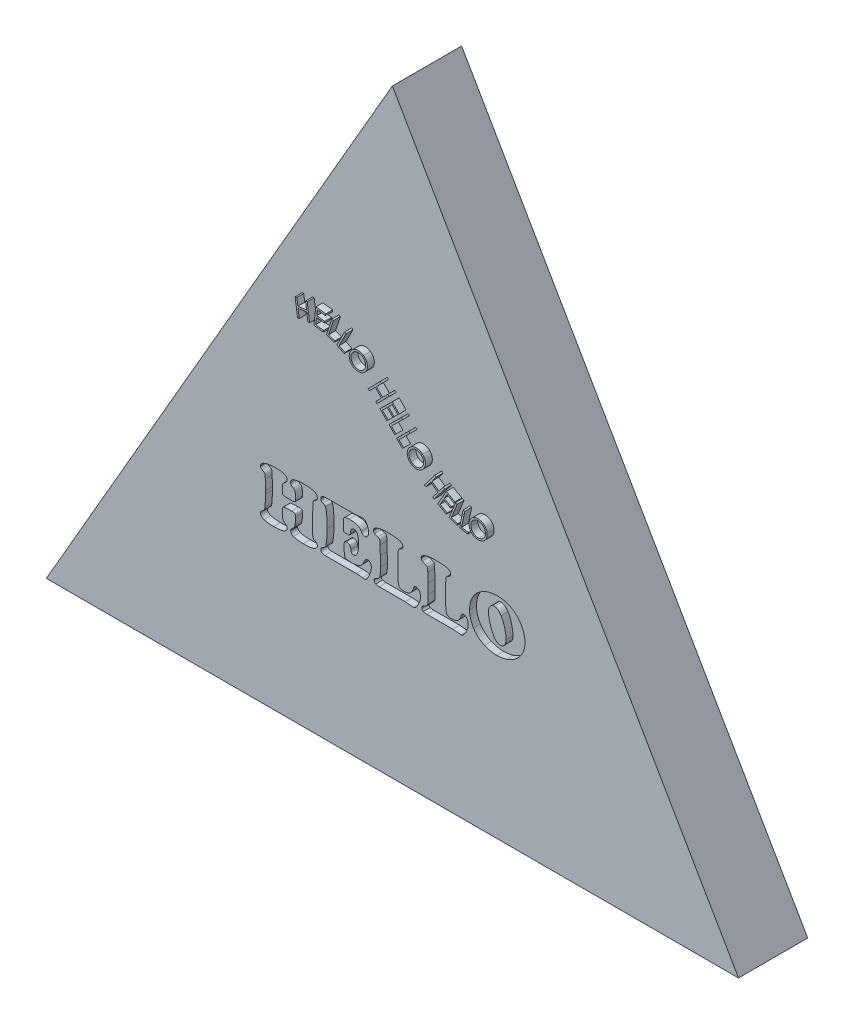
from build123d import *

# Parameters (mm, degrees)
BOSS_EXTRUDE1_DEPTH = 12.7
CUT_EXTRUDE1_DEPTH  = 1.27
BOSS_EXTRUDE2_DEPTH = 1.27


with BuildPart() as part:
    # Sketch1 → Boss-Extrude1 (new body)
    with BuildSketch(Plane.XY):
        Polygon((0, 73.323484187), (-63.5, -36.661742094), (63.5, -36.661742094), align=None)
    extrude(amount=BOSS_EXTRUDE1_DEPTH)

    # Sketch2 → Cut-Extrude1 (cut)
    # profile 1 of 5: a face of its own
    with BuildSketch(Plane.XY.offset(12.7)):
        with BuildLine():
            add(Edge.make_bspline(
                [(-21.364880701, 1.94454169), (-21.281738541, 1.943689922), (-21.120756138, 1.942040703), (-20.887381761, 1.9316671), (-20.669859548, 1.916731308), (-20.469372219, 1.892105144), (-20.284412175, 1.863072751), (-20.116554471, 1.82355693), (-19.961913114, 1.78395691), (-19.825949198, 1.729998973), (-19.703504153, 1.6750217), (-19.597642604, 1.610607324), (-19.50955397, 1.537722486), (-19.433713004, 1.460685823), (-19.378376364, 1.373666447), (-19.336457253, 1.281169867), (-19.311908867, 1.181550739), (-19.308941023, 1.112710655), (-19.307432432, 1.077718422)],
                knots=[0, 0, 0, 0, 1.628096232, 3.152369938, 4.574089313, 5.896317843, 7.107096042, 8.237714427, 9.272838329, 10.228578496, 11.097813438, 11.899380486, 12.645721967, 13.332912527, 14.006551698, 14.653035689, 15.315322028, 16, 16, 16, 16], degree=3))
            add(Edge.make_bspline(
                [(-19.307432432, 1.077718422), (-19.308346559, 1.040752977), (-19.310106908, 0.96956794), (-19.330405651, 0.867613959), (-19.36498357, 0.776210809), (-19.41283246, 0.691871933), (-19.480723552, 0.612728938), (-19.571731405, 0.535612959), (-19.682453449, 0.449555699), (-19.768078822, 0.396421046), (-19.814252534, 0.367768042)],
                knots=[0, 0, 0, 0, 0.960054161, 1.848793941, 2.687229373, 3.491451053, 4.357336666, 5.382133171, 6.588308286, 8, 8, 8, 8], degree=3))
            add(Edge.make_bspline(
                [(-19.814252534, 0.367768042), (-19.854232909, 0.339603162), (-19.931122428, 0.285436984), (-20.026359011, 0.183962068), (-20.098022348, 0.07013943), (-20.13758783, -0.03769798), (-20.157799299, -0.135957249), (-20.171464725, -0.226615171), (-20.184085468, -0.333870129), (-20.190377519, -0.458168504), (-20.199225638, -0.598862537), (-20.205566028, -0.756433114), (-20.206227972, -0.930795321), (-20.207685272, -1.052804856), (-20.208445946, -1.116490827)],
                knots=[0, 0, 0, 0, 1.090349952, 2.096940898, 3.085997206, 4.076413355, 4.643371592, 5.325446935, 6.124304054, 7.0548153, 8.104923165, 9.274001368, 10.577095874, 12, 12, 12, 12], degree=3))
            add(Edge.make_bspline(
                [(-20.208445946, -1.116490827), (-20.207635124, -1.187932685), (-20.206176954, -1.316412767), (-20.171115037, -1.483968742), (-20.125016454, -1.617254793), (-20.063316421, -1.669937455), (-20.03548353, -1.693702609)],
                knots=[0, 0, 0, 0, 1.369385572, 2.462684685, 3.30651693, 4, 4, 4, 4], degree=3))
            add(Edge.make_bspline(
                [(-20.03548353, -1.693702609), (-20.017001531, -1.70437437), (-19.977541002, -1.727159423), (-19.907256042, -1.750412918), (-19.825120321, -1.768268376), (-19.745393584, -1.776751585), (-19.668059894, -1.777705811), (-19.591748689, -1.783245955), (-19.498497249, -1.784634945), (-19.38787313, -1.783614288), (-19.259836316, -1.786462244), (-19.115037073, -1.788782279), (-18.953461683, -1.788065116), (-18.840165353, -1.788172191), (-18.780500422, -1.78822858)],
                knots=[0, 0, 0, 0, 0.603934358, 1.289447571, 2.087528818, 2.986168803, 3.556867064, 4.280350238, 5.155141795, 6.200841159, 7.417803491, 8.786851047, 10.307868303, 12, 12, 12, 12], degree=3))
            add(Edge.make_bspline(
                [(-18.780500422, -1.78822858), (-18.726200572, -1.787462957), (-18.622962959, -1.786007315), (-18.476072792, -1.785405626), (-18.345317147, -1.778914026), (-18.230685239, -1.770847922), (-18.131740897, -1.762202717), (-18.050232085, -1.747190701), (-17.983680035, -1.734396263), (-17.918196086, -1.71164053), (-17.850462454, -1.666352739), (-17.79929205, -1.580453056), (-17.766001948, -1.470866399), (-17.763963945, -1.388994229), (-17.762837838, -1.343755396)],
                knots=[0, 0, 0, 0, 1.519990792, 2.889883168, 4.11083427, 5.183006209, 6.107211058, 6.887662514, 7.502305182, 8.000874094, 8.823280579, 9.718457699, 10.739323604, 12, 12, 12, 12], degree=3))
            add(Edge.make_bspline(
                [(-17.762837838, -1.343755396), (-17.763352123, -1.272691736), (-17.764341959, -1.135916956), (-17.768255944, -0.939469538), (-17.774425408, -0.759796812), (-17.781574069, -0.596761194), (-17.793875626, -0.450602627), (-17.807999362, -0.321203969), (-17.822978937, -0.208134295), (-17.849306667, -0.083950509), (-17.887704036, 0.051090321), (-17.962357339, 0.18560723), (-18.051917439, 0.298363616), (-18.130552478, 0.346287527), (-18.169098395, 0.369779232)],
                knots=[0, 0, 0, 0, 1.393616218, 2.682264795, 3.852988993, 4.919172408, 5.882120472, 6.728529464, 7.47222126, 8.116813738, 9.218711156, 10.207080071, 11.121132958, 12, 12, 12, 12], degree=3))
            add(Edge.make_bspline(
                [(-18.169098395, 0.369779232), (-18.21601341, 0.395571869), (-18.302252122, 0.442983635), (-18.411676539, 0.522445803), (-18.502924956, 0.585386024), (-18.567278522, 0.651192685), (-18.612529325, 0.719437403), (-18.642175501, 0.794833783), (-18.66091092, 0.879041991), (-18.662841099, 0.938167783), (-18.663851351, 0.969114114)],
                knots=[0, 0, 0, 0, 1.5523506, 2.853515363, 3.924023089, 4.763676975, 5.508659231, 6.28574915, 7.102764221, 8, 8, 8, 8], degree=3))
            add(Edge.make_bspline(
                [(-18.663851351, 0.969114114), (-18.66190296, 1.014362137), (-18.65801243, 1.104712956), (-18.6147851, 1.234832766), (-18.548784876, 1.358613734), (-18.458170922, 1.473249847), (-18.348854533, 1.579008725), (-18.217397511, 1.66195276), (-18.074050089, 1.733370847), (-17.969307737, 1.76130281), (-17.915688345, 1.775601656)],
                knots=[0, 0, 0, 0, 0.913260048, 1.823588922, 2.746785275, 3.743427444, 4.771028587, 5.81031195, 6.879061427, 8, 8, 8, 8], degree=3))
            add(Edge.make_bspline(
                [(-17.915688345, 1.775601656), (-17.792671975, 1.80235876), (-17.533562384, 1.858717292), (-17.1182369, 1.906574113), (-16.659934554, 1.940295129), (-16.339661744, 1.943082426), (-16.171985853, 1.94454169)],
                knots=[0, 0, 0, 0, 0.860014393, 1.811449788, 2.854204615, 4, 4, 4, 4], degree=3))
            add(Edge.make_bspline(
                [(-16.171985853, 1.94454169), (-16.072762135, 1.943610773), (-15.880966748, 1.941811349), (-15.603232906, 1.932550065), (-15.345759523, 1.913896619), (-15.108734628, 1.891027108), (-14.891923546, 1.85876899), (-14.695854933, 1.819186729), (-14.519337787, 1.772556913), (-14.361919168, 1.721636525), (-14.223755611, 1.661044014), (-14.103914216, 1.592870783), (-14.002019176, 1.516236023), (-13.918085317, 1.431130762), (-13.852655883, 1.337361988), (-13.80508035, 1.235555273), (-13.779137779, 1.12456998), (-13.774836365, 1.04834549), (-13.772635135, 1.009337932)],
                knots=[0, 0, 0, 0, 1.688939915, 3.264651735, 4.728829141, 6.082237995, 7.316759167, 8.458058793, 9.48489629, 10.423076314, 11.271161873, 12.048180413, 12.76478781, 13.434529674, 14.073937073, 14.70194116, 15.335723914, 16, 16, 16, 16], degree=3))
            add(Edge.make_bspline(
                [(-13.772635135, 1.009337932), (-13.776949637, 0.944901578), (-13.785281361, 0.820468681), (-13.859924635, 0.647430916), (-13.984309151, 0.5028773), (-14.093528591, 0.435329453), (-14.15073902, 0.399947096)],
                knots=[0, 0, 0, 0, 1.019855957, 1.969441511, 2.936369554, 4, 4, 4, 4], degree=3))
            add(Edge.make_bspline(
                [(-14.15073902, 0.399947096), (-14.187472334, 0.380705442), (-14.255383292, 0.345132306), (-14.342279781, 0.283224558), (-14.411959505, 0.226876025), (-14.463254751, 0.165739403), (-14.499782627, 0.092074297), (-14.527384567, -0.000734662), (-14.556664964, -0.116563433), (-14.569877446, -0.202574924), (-14.577111486, -0.249667558)],
                knots=[0, 0, 0, 0, 1.204318731, 2.226492255, 3.097709153, 3.804139944, 4.527845433, 5.471119652, 6.615398503, 8, 8, 8, 8], degree=3))
            add(Edge.make_bspline(
                [(-14.577111486, -0.249667558), (-14.579286876, -0.26976642), (-14.585004389, -0.322591669), (-14.589250628, -0.419991675), (-14.599173945, -0.553896816), (-14.60285674, -0.723685637), (-14.612503255, -0.930074357), (-14.619130809, -1.172835474), (-14.630803395, -1.452294899), (-14.637306967, -1.758736715), (-14.645206982, -2.07449488), (-14.653744479, -2.382178957), (-14.659845014, -2.673136511), (-14.663391028, -2.946677586), (-14.667381635, -3.202770032), (-14.671914406, -3.441413811), (-14.674032403, -3.663325012), (-14.673773306, -3.805452766), (-14.673648649, -3.873833521)],
                knots=[0, 0, 0, 0, 0.267567751, 0.703240451, 1.290042881, 2.044858848, 2.950770167, 4.025190875, 5.25956673, 6.653340819, 8.082602326, 9.440889582, 10.727990978, 11.935075526, 13.062297363, 14.118531296, 15.094784466, 16, 16, 16, 16], degree=3))
            add(Edge.make_bspline(
                [(-14.673648649, -3.873833521), (-14.673102579, -3.983108953), (-14.672060655, -4.191610987), (-14.668641867, -4.488633643), (-14.661006937, -4.754180151), (-14.648652284, -4.988139103), (-14.634868975, -5.191343763), (-14.619509803, -5.363807479), (-14.601320361, -5.505248336), (-14.581700724, -5.587477052), (-14.573089105, -5.623569585)],
                knots=[0, 0, 0, 0, 1.493944024, 2.850506858, 4.060859127, 5.125435233, 6.053333751, 6.844937718, 7.493010154, 8, 8, 8, 8], degree=3))
            add(Edge.make_bspline(
                [(-14.573089105, -5.623569585), (-14.5642921, -5.654608943), (-14.548020819, -5.712020538), (-14.517294373, -5.788241634), (-14.48888352, -5.849698999), (-14.451254308, -5.90061945), (-14.389812103, -5.945474133), (-14.30097132, -6.002671404), (-14.177890497, -6.08029352), (-14.081977117, -6.134247817), (-14.028056377, -6.164579931)],
                knots=[0, 0, 0, 0, 0.963719526, 1.782532871, 2.454786267, 2.983929362, 3.653788259, 4.709984661, 6.150413827, 8, 8, 8, 8], degree=3))
            add(Edge.make_bspline(
                [(-14.028056377, -6.164579931), (-13.988676249, -6.189237556), (-13.913459664, -6.236333956), (-13.831656977, -6.341319059), (-13.780668883, -6.463882417), (-13.775376777, -6.552887152), (-13.772635135, -6.598997161)],
                knots=[0, 0, 0, 0, 1.044256536, 1.994544328, 2.961048781, 4, 4, 4, 4], degree=3))
            add(Edge.make_bspline(
                [(-13.772635135, -6.598997161), (-13.774615169, -6.640717082), (-13.778463593, -6.721804584), (-13.807194856, -6.839308172), (-13.856738377, -6.946904686), (-13.923366375, -7.04734319), (-14.012263067, -7.135875691), (-14.118221036, -7.217239583), (-14.243454441, -7.289116507), (-14.388685772, -7.351737313), (-14.555328875, -7.40527722), (-14.743997822, -7.453277513), (-14.95628672, -7.493179499), (-15.192710417, -7.524387199), (-15.452910043, -7.550604281), (-15.736688168, -7.56823101), (-16.043872408, -7.577839818), (-16.256449025, -7.57956207), (-16.367071368, -7.58045831)],
                knots=[0, 0, 0, 0, 0.658302352, 1.279486915, 1.895238273, 2.520466756, 3.17158368, 3.865907673, 4.624673217, 5.444598045, 6.358272751, 7.385028164, 8.516266582, 9.766051562, 11.148758305, 12.644057389, 14.253607379, 16, 16, 16, 16], degree=3))
            add(Edge.make_bspline(
                [(-16.367071368, -7.58045831), (-16.464285594, -7.579553504), (-16.651393143, -7.577812031), (-16.922407651, -7.568267718), (-17.173974016, -7.550269826), (-17.406290902, -7.525118993), (-17.618813584, -7.490170408), (-17.811880691, -7.45118673), (-17.985388459, -7.403594525), (-18.092240698, -7.363959712), (-18.142952914, -7.345148977)],
                knots=[0, 0, 0, 0, 1.295452867, 2.493349176, 3.612903322, 4.655654194, 5.605865937, 6.481876884, 7.279496729, 8, 8, 8, 8], degree=3))
            add(Edge.make_bspline(
                [(-18.142952914, -7.345148977), (-18.184331955, -7.326648066), (-18.263116949, -7.291422643), (-18.369571517, -7.22559855), (-18.460569234, -7.154388369), (-18.534448969, -7.073780517), (-18.594454401, -6.987391556), (-18.634529434, -6.890620532), (-18.659452948, -6.787304544), (-18.662369203, -6.715790762), (-18.663851351, -6.679444796)],
                knots=[0, 0, 0, 0, 1.204000434, 2.292396479, 3.319663725, 4.265775454, 5.190314256, 6.100827029, 7.034769612, 8, 8, 8, 8], degree=3))
            add(Edge.make_bspline(
                [(-18.663851351, -6.679444796), (-18.65959384, -6.61827243), (-18.65126547, -6.498609535), (-18.572598191, -6.331482078), (-18.444859634, -6.189081744), (-18.334081666, -6.119039694), (-18.275691512, -6.082121105)],
                knots=[0, 0, 0, 0, 0.975362193, 1.907963852, 2.897304973, 4, 4, 4, 4], degree=3))
            add(Edge.make_bspline(
                [(-18.275691512, -6.082121105), (-18.220369335, -6.049203062), (-18.1234358, -5.991525248), (-18.024108481, -5.891734324), (-17.978278592, -5.796771862), (-17.944051628, -5.708213727), (-17.913434885, -5.596477276), (-17.892741677, -5.514993168), (-17.8814981, -5.470719078)],
                knots=[0, 0, 0, 0, 1.523756998, 2.669872372, 3.259304881, 4.008292234, 4.917812942, 6, 6, 6, 6], degree=3))
            add(Edge.make_bspline(
                [(-17.8814981, -5.470719078), (-17.862656228, -5.371712234), (-17.823002301, -5.163345977), (-17.790253614, -4.832406094), (-17.767164816, -4.47014952), (-17.764322325, -4.218462761), (-17.762837838, -4.087019754)],
                knots=[0, 0, 0, 0, 0.869064507, 1.829002022, 2.866199778, 4, 4, 4, 4], degree=3))
            add(Edge.make_bspline(
                [(-17.762837838, -4.087019754), (-17.764311031, -4.023292186), (-17.766974005, -3.908096928), (-17.786394061, -3.75442482), (-17.822075982, -3.639665829), (-17.879819661, -3.553652904), (-17.980626822, -3.509575968), (-18.115545753, -3.479720207), (-18.299589999, -3.464329454), (-18.43794224, -3.462537662), (-18.515023226, -3.461539391)],
                knots=[0, 0, 0, 0, 1.277425478, 2.309100469, 3.090855737, 3.676613965, 4.313593519, 5.225965603, 6.454486139, 8, 8, 8, 8], degree=3))
            add(Edge.make_bspline(
                [(-18.515023226, -3.461539391), (-18.608214653, -3.461858132), (-18.785903516, -3.462465878), (-19.038657725, -3.468788435), (-19.264816907, -3.477290619), (-19.463732298, -3.494955342), (-19.637360534, -3.510418414), (-19.783750715, -3.536326932), (-19.905548836, -3.558587999), (-19.974717389, -3.584726306), (-20.005315667, -3.59628918)],
                knots=[0, 0, 0, 0, 1.488623199, 2.838370145, 4.038999913, 5.102670839, 6.028695248, 6.820962067, 7.478425817, 8, 8, 8, 8], degree=3))
            add(Edge.make_bspline(
                [(-20.005315667, -3.59628918), (-20.025851763, -3.608452155), (-20.070174826, -3.63470351), (-20.1175658, -3.705969091), (-20.151594889, -3.800244097), (-20.162287033, -3.872138388), (-20.168222128, -3.912046148)],
                knots=[0, 0, 0, 0, 0.765186288, 1.651501916, 2.696373613, 4, 4, 4, 4], degree=3))
            add(Edge.make_bspline(
                [(-20.168222128, -3.912046148), (-20.174786215, -3.968983091), (-20.188507109, -4.08799825), (-20.199215829, -4.27731217), (-20.208023619, -4.484480987), (-20.208301769, -4.629358811), (-20.208445946, -4.704455354)],
                knots=[0, 0, 0, 0, 0.866119573, 1.81044771, 2.865058826, 4, 4, 4, 4], degree=3))
            add(Edge.make_bspline(
                [(-20.208445946, -4.704455354), (-20.20755564, -4.766145598), (-20.20584154, -4.884917303), (-20.196100432, -5.0567711), (-20.17894205, -5.214757682), (-20.151734799, -5.359521567), (-20.120951631, -5.490910904), (-20.082350196, -5.60942739), (-20.037500367, -5.71493501), (-19.998087183, -5.776864089), (-19.979170186, -5.806587955)],
                knots=[0, 0, 0, 0, 1.298040353, 2.499106075, 3.620672539, 4.638833945, 5.596783011, 6.457699266, 7.259747748, 8, 8, 8, 8], degree=3))
            add(Edge.make_bspline(
                [(-19.979170186, -5.806587955), (-19.96220144, -5.825831619), (-19.922204031, -5.871191288), (-19.840586931, -5.935339036), (-19.733149163, -6.007503594), (-19.651637216, -6.055756295), (-19.607099873, -6.082121105)],
                knots=[0, 0, 0, 0, 0.66075475, 1.557479728, 2.665430454, 4, 4, 4, 4], degree=3))
            add(Edge.make_bspline(
                [(-19.607099873, -6.082121105), (-19.561357702, -6.110404515), (-19.471834237, -6.16575888), (-19.375168138, -6.292462875), (-19.315276571, -6.444485351), (-19.310143469, -6.554808554), (-19.307432432, -6.613075497)],
                knots=[0, 0, 0, 0, 0.996720318, 1.950713175, 2.917673916, 4, 4, 4, 4], degree=3))
            add(Edge.make_bspline(
                [(-19.307432432, -6.613075497), (-19.309237612, -6.65151372), (-19.312780547, -6.726954499), (-19.344859827, -6.836043956), (-19.395281193, -6.938067172), (-19.468758985, -7.031644464), (-19.558622101, -7.120831961), (-19.672211224, -7.198768033), (-19.803694046, -7.271118882), (-19.95450064, -7.336973492), (-20.124103169, -7.394938944), (-20.311049524, -7.444537744), (-20.514515104, -7.486688376), (-20.735505381, -7.520049195), (-20.973459047, -7.549158915), (-21.229302228, -7.565284513), (-21.501503638, -7.578573715), (-21.688662885, -7.579816928), (-21.785219595, -7.58045831)],
                knots=[0, 0, 0, 0, 0.636854384, 1.249922308, 1.872116304, 2.515454065, 3.215946141, 3.966385357, 4.793393297, 5.705386232, 6.694467267, 7.766318104, 8.914504595, 10.1423568, 11.475978507, 12.893051799, 14.397104604, 16, 16, 16, 16], degree=3))
            add(Edge.make_bspline(
                [(-21.785219595, -7.58045831), (-21.95832888, -7.578395744), (-22.288410867, -7.574462877), (-22.758333454, -7.527794155), (-23.181245868, -7.463857862), (-23.440380305, -7.387396438), (-23.563112331, -7.35118255)],
                knots=[0, 0, 0, 0, 1.153865524, 2.200172125, 3.147560142, 4, 4, 4, 4], degree=3))
            add(Edge.make_bspline(
                [(-23.563112331, -7.35118255), (-23.610462837, -7.333423457), (-23.701924976, -7.299120031), (-23.828326536, -7.232616878), (-23.936821187, -7.153481441), (-24.031171476, -7.067188416), (-24.105657372, -6.9713384), (-24.158624761, -6.868973764), (-24.193430675, -6.762802255), (-24.196911192, -6.689761099), (-24.198648649, -6.653299315)],
                knots=[0, 0, 0, 0, 1.20433831, 2.326297409, 3.390357565, 4.396230361, 5.364356467, 6.264603531, 7.133698674, 8, 8, 8, 8], degree=3))
            add(Edge.make_bspline(
                [(-24.198648649, -6.653299315), (-24.19743756, -6.618374077), (-24.195140847, -6.552141748), (-24.179522814, -6.458489049), (-24.152253258, -6.37678592), (-24.108027302, -6.304323074), (-24.043120255, -6.236038658), (-23.955346424, -6.161565266), (-23.840192518, -6.080124015), (-23.753128212, -6.025348603), (-23.705906883, -5.995639898)],
                knots=[0, 0, 0, 0, 0.959014547, 1.818678161, 2.598963532, 3.309436644, 4.130577555, 5.175041176, 6.467818596, 8, 8, 8, 8], degree=3))
            add(Edge.make_bspline(
                [(-23.705906883, -5.995639898), (-23.657614926, -5.962314099), (-23.564436749, -5.89801277), (-23.484226171, -5.775191068), (-23.441894854, -5.659019507), (-23.418186998, -5.544975344), (-23.392959904, -5.407110757), (-23.383285748, -5.305921252), (-23.37808277, -5.251499273)],
                knots=[0, 0, 0, 0, 1.233291135, 2.379605709, 3.031243086, 3.847760908, 4.842477684, 6, 6, 6, 6], degree=3))
            add(Edge.make_bspline(
                [(-23.37808277, -5.251499273), (-23.371185597, -5.183137729), (-23.35686105, -5.041159547), (-23.338470026, -4.819954115), (-23.325223036, -4.583175786), (-23.313182789, -4.331770001), (-23.302524018, -4.065639517), (-23.297356632, -3.784014587), (-23.293081161, -3.487026683), (-23.292102288, -3.283885961), (-23.291601562, -3.179972668)],
                knots=[0, 0, 0, 0, 0.794988125, 1.651088636, 2.568001603, 3.538719484, 4.563352996, 5.649556022, 6.797669065, 8, 8, 8, 8], degree=3))
            add(Edge.make_bspline(
                [(-23.291601562, -3.179972668), (-23.29216039, -3.093490284), (-23.293369055, -2.906441072), (-23.296143472, -2.719408366), (-23.297635135, -2.618850413)],
                knots=[0, 0, 0, 0, 0.924701932, 2, 2, 2, 2], degree=3))
            add(Edge.make_bspline(
                [(-23.297635135, -2.618850413), (-23.299795166, -2.490806616), (-23.303877634, -2.248803307), (-23.307384856, -1.907555428), (-23.311199867, -1.609895665), (-23.3159827, -1.356504699), (-23.317561142, -1.146656548), (-23.319154878, -0.980393051), (-23.322114302, -0.857055629), (-23.321867257, -0.789337942), (-23.321769426, -0.762521232)],
                knots=[0, 0, 0, 0, 1.655525291, 3.128949707, 4.411724019, 5.503853516, 6.405221863, 7.124602094, 7.653335892, 8, 8, 8, 8], degree=3))
            add(Edge.make_bspline(
                [(-23.321769426, -0.762521232), (-23.322139182, -0.674023218), (-23.32281226, -0.512927694), (-23.336762441, -0.295366165), (-23.364775252, -0.127106606), (-23.407430354, 0.005092767), (-23.486017683, 0.110298584), (-23.595784201, 0.210663481), (-23.744494216, 0.314760357), (-23.860074713, 0.378991822), (-23.923115498, 0.414025432)],
                knots=[0, 0, 0, 0, 1.476694817, 2.688070785, 3.631531683, 4.321524081, 4.979492462, 5.79452198, 6.797071558, 8, 8, 8, 8], degree=3))
            add(Edge.make_bspline(
                [(-23.923115498, 0.414025432), (-23.964965728, 0.438707632), (-24.044650689, 0.485703792), (-24.13474998, 0.587730153), (-24.188537821, 0.70895288), (-24.195203034, 0.79560346), (-24.198648649, 0.840397898)],
                knots=[0, 0, 0, 0, 1.083743496, 2.063502576, 2.998918245, 4, 4, 4, 4], degree=3))
            add(Edge.make_bspline(
                [(-24.198648649, 0.840397898), (-24.194995963, 0.895992767), (-24.187771511, 1.005950892), (-24.122294857, 1.162144128), (-24.018914146, 1.304451085), (-23.871170884, 1.428260801), (-23.687860678, 1.54169331), (-23.462998706, 1.638657084), (-23.199786915, 1.72484178), (-23.008481133, 1.767274066), (-22.907464105, 1.789679993)],
                knots=[0, 0, 0, 0, 0.767181298, 1.517366954, 2.308731731, 3.184133086, 4.168562005, 5.286911315, 6.567381754, 8, 8, 8, 8], degree=3))
            add(Edge.make_bspline(
                [(-22.907464105, 1.789679993), (-22.781666496, 1.813925026), (-22.529115059, 1.862599386), (-22.144836169, 1.909424762), (-21.756172461, 1.938331853), (-21.495659242, 1.942466222), (-21.364880701, 1.94454169)],
                knots=[0, 0, 0, 0, 0.989737449, 1.986998137, 2.989466067, 4, 4, 4, 4], degree=3))
        make_face()
    # profile 2 of 5: a face of its own
    with BuildSketch(Plane.XY.offset(12.7)):
        with BuildLine():
            Line((-11.638761613, 1.815825474), (-8.157390203, 1.815825474))
            add(Edge.make_bspline(
                [(-8.157390203, 1.815825474), (-8.072248244, 1.815526579), (-7.907995168, 1.814949962), (-7.670692421, 1.818938665), (-7.450761923, 1.816199262), (-7.249024808, 1.822752922), (-7.064617207, 1.822986378), (-6.899049499, 1.827749378), (-6.750894174, 1.831763935), (-6.498466415, 1.838660775), (-6.139064993, 1.866040106), (-5.824935256, 1.905105567), (-5.669547086, 1.924429781)],
                knots=[0, 0, 0, 0, 1.024785291, 1.976982194, 2.856522325, 3.671668823, 4.40600813, 5.075944108, 5.665214953, 6.189959586, 8.115316269, 10, 10, 10, 10], degree=3))
            add(Edge.make_bspline(
                [(-5.669547086, 1.924429781), (-5.627398115, 1.930815106), (-5.553363826, 1.942030871), (-5.47853319, 1.94378585), (-5.446304899, 1.94454169)],
                knots=[0, 0, 0, 0, 1.138633758, 2, 2, 2, 2], degree=3))
            add(Edge.make_bspline(
                [(-5.446304899, 1.94454169), (-5.388594399, 1.940471606), (-5.272354328, 1.932273673), (-5.106357046, 1.85744128), (-4.952580818, 1.739633761), (-4.867691757, 1.635526969), (-4.822835726, 1.580516141)],
                knots=[0, 0, 0, 0, 0.920642556, 1.854351584, 2.866222926, 4, 4, 4, 4], degree=3))
            add(Edge.make_bspline(
                [(-4.822835726, 1.580516141), (-4.78693927, 1.530911618), (-4.714940079, 1.43141752), (-4.625771355, 1.270093264), (-4.54897317, 1.10183562), (-4.483551527, 0.926970983), (-4.436054875, 0.743422367), (-4.402293853, 0.552405939), (-4.378648414, 0.354279752), (-4.377123178, 0.219010639), (-4.376351351, 0.150559427)],
                knots=[0, 0, 0, 0, 0.962789209, 1.931111073, 2.894131444, 3.872060138, 4.864897485, 5.872643803, 6.923478476, 8, 8, 8, 8], degree=3))
            add(Edge.make_bspline(
                [(-4.376351351, 0.150559427), (-4.37861129, 0.084030168), (-4.382935833, -0.043278005), (-4.416846187, -0.223029505), (-4.472570087, -0.381796792), (-4.553420374, -0.516000309), (-4.654453758, -0.62440304), (-4.774375233, -0.704411966), (-4.913703055, -0.749030868), (-5.011582568, -0.755272914), (-5.062167441, -0.75849885)],
                knots=[0, 0, 0, 0, 1.245518878, 2.383383401, 3.412293198, 4.381455077, 5.296464025, 6.167229514, 7.052810346, 8, 8, 8, 8], degree=3))
            add(Edge.make_bspline(
                [(-5.062167441, -0.75849885), (-5.097131668, -0.757532485), (-5.163559906, -0.755696497), (-5.256834097, -0.736914752), (-5.338969362, -0.709601196), (-5.413546, -0.666581048), (-5.481920285, -0.597868175), (-5.557755461, -0.50605864), (-5.646869508, -0.387715466), (-5.704500229, -0.295768241), (-5.735916385, -0.245645176)],
                knots=[0, 0, 0, 0, 0.932689192, 1.772008234, 2.530874441, 3.23721939, 4.047973162, 5.102637345, 6.420564679, 8, 8, 8, 8], degree=3))
            add(Edge.make_bspline(
                [(-5.735916385, -0.245645176), (-5.786177032, -0.173667486), (-5.883714691, -0.033984936), (-6.060535312, 0.144724409), (-6.260611686, 0.280854935), (-6.44425818, 0.36334254), (-6.606310053, 0.410999595), (-6.746206809, 0.442137669), (-6.903737479, 0.47075365), (-7.079657166, 0.492497763), (-7.273645686, 0.507618298), (-7.485540036, 0.519582718), (-7.714858575, 0.528182443), (-7.873803704, 0.528499045), (-7.956271115, 0.528663312)],
                knots=[0, 0, 0, 0, 1.27529588, 2.474886037, 3.632331053, 4.775728887, 5.386478418, 6.086570391, 6.859212663, 7.714204194, 8.663152188, 9.688558153, 10.800726859, 12, 12, 12, 12], degree=3))
            add(Edge.make_bspline(
                [(-7.956271115, 0.528663312), (-8.017316863, 0.528205224), (-8.132889397, 0.527337966), (-8.296704335, 0.512600889), (-8.441480167, 0.491729019), (-8.567835071, 0.461063071), (-8.67732633, 0.425048471), (-8.766782582, 0.375622568), (-8.841233502, 0.32046173), (-8.87381795, 0.272254797), (-8.889463682, 0.24910778)],
                knots=[0, 0, 0, 0, 1.449004219, 2.74327195, 3.902759495, 4.918229825, 5.829530337, 6.627402312, 7.34093416, 8, 8, 8, 8], degree=3))
            add(Edge.make_bspline(
                [(-8.889463682, 0.24910778), (-8.902983189, 0.222618935), (-8.931564686, 0.16661905), (-8.960124854, 0.071320329), (-8.982369887, -0.036316609), (-8.993759946, -0.137460498), (-8.999054354, -0.236203964), (-8.999479214, -0.336182706), (-9.005264255, -0.46012921), (-9.005819282, -0.609007149), (-9.009008433, -0.781952049), (-9.00725763, -0.979737727), (-9.010993022, -1.201624027), (-9.010431536, -1.357832293), (-9.010135135, -1.440292558)],
                knots=[0, 0, 0, 0, 0.626450345, 1.324374362, 2.090114948, 2.944659653, 3.468842886, 4.176307467, 5.053844368, 6.086633028, 7.317456574, 8.70380991, 10.259985099, 12, 12, 12, 12], degree=3))
            add(Edge.make_bspline(
                [(-9.010135135, -1.440292558), (-9.009129203, -1.502100624), (-9.007325913, -1.612901161), (-8.983140576, -1.760416188), (-8.949514398, -1.872508112), (-8.888025922, -1.956552626), (-8.782209225, -1.997171582), (-8.641996451, -2.027376409), (-8.449882711, -2.042942862), (-8.306193576, -2.044685601), (-8.225770693, -2.045661012)],
                knots=[0, 0, 0, 0, 1.226254133, 2.198250555, 2.960541532, 3.538688477, 4.187916338, 5.144094922, 6.401548444, 8, 8, 8, 8], degree=3))
            add(Edge.make_bspline(
                [(-8.225770693, -2.045661012), (-8.184820608, -2.043919691), (-8.108398802, -2.040670006), (-8.001572783, -2.022254035), (-7.913099931, -1.98575265), (-7.839217156, -1.933488857), (-7.785182042, -1.858075953), (-7.736838964, -1.766343943), (-7.707769944, -1.649205461), (-7.694120357, -1.564391893), (-7.686771537, -1.518729002)],
                knots=[0, 0, 0, 0, 1.148280208, 2.142941769, 3.018562819, 3.811280035, 4.641605983, 5.59089133, 6.702956762, 8, 8, 8, 8], degree=3))
            add(Edge.make_bspline(
                [(-7.686771537, -1.518729002), (-7.678168943, -1.459720984), (-7.662507384, -1.352293214), (-7.639567554, -1.205614638), (-7.613961428, -1.090076218), (-7.580700911, -0.974293325), (-7.512067454, -0.853164143), (-7.429896271, -0.784303407), (-7.387104096, -0.748442896)],
                knots=[0, 0, 0, 0, 1.25799805, 2.290263741, 3.130847905, 3.752611531, 4.829630574, 6, 6, 6, 6], degree=3))
            add(Edge.make_bspline(
                [(-7.387104096, -0.748442896), (-7.361596121, -0.729911234), (-7.311220985, -0.693313466), (-7.224443685, -0.657735408), (-7.132904721, -0.634513361), (-7.069484803, -0.631379898), (-7.037156883, -0.629782634)],
                knots=[0, 0, 0, 0, 1.002301656, 1.979423375, 2.970023272, 4, 4, 4, 4], degree=3))
            add(Edge.make_bspline(
                [(-7.037156883, -0.629782634), (-6.989711566, -0.632579538), (-6.895368894, -0.638141043), (-6.76141257, -0.692817953), (-6.637457746, -0.77621301), (-6.570923859, -0.853243737), (-6.536370355, -0.893248639)],
                knots=[0, 0, 0, 0, 0.967513104, 1.923852042, 2.921779686, 4, 4, 4, 4], degree=3))
            add(Edge.make_bspline(
                [(-6.536370355, -0.893248639), (-6.510984627, -0.931450271), (-6.454445652, -1.016532771), (-6.391446713, -1.174748201), (-6.331783349, -1.367830305), (-6.260612268, -1.676854895), (-6.192314462, -2.099209262), (-6.183078987, -2.447575116), (-6.178378378, -2.624883985)],
                knots=[0, 0, 0, 0, 0.460679252, 1.026022718, 1.704773129, 2.495382343, 4.216243673, 6, 6, 6, 6], degree=3))
            add(Edge.make_bspline(
                [(-6.178378378, -2.624883985), (-6.179696428, -2.71205418), (-6.182273974, -2.882522016), (-6.197683133, -3.13166954), (-6.226646616, -3.368455656), (-6.263815276, -3.593669107), (-6.313896186, -3.807453024), (-6.376764393, -4.008646447), (-6.448176726, -4.198662677), (-6.505980071, -4.318027811), (-6.534359164, -4.376631241)],
                knots=[0, 0, 0, 0, 1.159637826, 2.267758504, 3.318597917, 4.331674823, 5.302909241, 6.236568697, 7.134226895, 8, 8, 8, 8], degree=3))
            add(Edge.make_bspline(
                [(-6.534359164, -4.376631241), (-6.568382091, -4.433125004), (-6.633199347, -4.540751569), (-6.773698597, -4.663551179), (-6.943115209, -4.735584365), (-7.06461108, -4.744220101), (-7.127660473, -4.748701553)],
                knots=[0, 0, 0, 0, 1.066474735, 2.031746621, 2.978589318, 4, 4, 4, 4], degree=3))
            add(Edge.make_bspline(
                [(-7.127660473, -4.748701553), (-7.165985376, -4.747248414), (-7.236685851, -4.744567712), (-7.334273648, -4.723209789), (-7.413009112, -4.685292595), (-7.476319436, -4.627565898), (-7.519926521, -4.542093495), (-7.556436979, -4.429951662), (-7.590544971, -4.286652762), (-7.605945936, -4.179701327), (-7.614368666, -4.121209999)],
                knots=[0, 0, 0, 0, 1.015378293, 1.873135238, 2.628096877, 3.307085832, 4.102775046, 5.136796998, 6.434125282, 8, 8, 8, 8], degree=3))
            add(Edge.make_bspline(
                [(-7.614368666, -4.121209999), (-7.62482855, -4.059197459), (-7.644709415, -3.941331623), (-7.698031793, -3.778041646), (-7.77378506, -3.641369794), (-7.865111457, -3.526401538), (-7.978241346, -3.43938597), (-8.108286536, -3.374709447), (-8.258103095, -3.339118755), (-8.363691831, -3.334983291), (-8.418845017, -3.332823175)],
                knots=[0, 0, 0, 0, 1.203369458, 2.287217176, 3.269708319, 4.181928445, 5.078111489, 5.979428194, 6.944575167, 8, 8, 8, 8], degree=3))
            add(Edge.make_bspline(
                [(-8.418845017, -3.332823175), (-8.46008426, -3.334618061), (-8.537940491, -3.338006655), (-8.644542293, -3.377111157), (-8.72932195, -3.442574918), (-8.793596758, -3.536196241), (-8.832948833, -3.663723828), (-8.862043931, -3.82703523), (-8.878650167, -4.032405566), (-8.880441336, -4.18353334), (-8.881418919, -4.266015742)],
                knots=[0, 0, 0, 0, 0.832306821, 1.571325446, 2.258500912, 2.970452112, 3.833643863, 4.938881836, 6.329305254, 8, 8, 8, 8], degree=3))
            add(Edge.make_bspline(
                [(-8.881418919, -4.266015742), (-8.881092975, -4.324347284), (-8.880395852, -4.449105868), (-8.871729831, -4.64827675), (-8.856854009, -4.871445857), (-8.840380348, -5.107565468), (-8.819358352, -5.333542772), (-8.797106187, -5.52726894), (-8.777454899, -5.677369088), (-8.758502954, -5.761751867), (-8.750691512, -5.796532001)],
                knots=[0, 0, 0, 0, 0.910186795, 1.94669319, 3.110196011, 4.400366779, 5.640143457, 6.65099242, 7.443978203, 8, 8, 8, 8], degree=3))
            add(Edge.make_bspline(
                [(-8.750691512, -5.796532001), (-8.739478425, -5.829932975), (-8.717108373, -5.896567749), (-8.641907043, -5.977138513), (-8.544696074, -6.042858424), (-8.415972053, -6.090966414), (-8.251702588, -6.1226061), (-8.046185395, -6.148895709), (-7.794824132, -6.160412588), (-7.61235918, -6.163118472), (-7.513809122, -6.164579931)],
                knots=[0, 0, 0, 0, 0.609961122, 1.216869309, 1.883832188, 2.652752773, 3.600637229, 4.806777803, 6.275327784, 8, 8, 8, 8], degree=3))
            add(Edge.make_bspline(
                [(-7.513809122, -6.164579931), (-7.434020765, -6.16380403), (-7.27970985, -6.162303434), (-7.056136426, -6.150936255), (-6.847483969, -6.128382748), (-6.654275052, -6.098465847), (-6.475199631, -6.063041542), (-6.312036739, -6.017638009), (-6.164990574, -5.960110318), (-6.029225199, -5.898054878), (-5.904773499, -5.822844778), (-5.790009205, -5.732375047), (-5.678460982, -5.632130403), (-5.573714007, -5.516681492), (-5.475427805, -5.386709207), (-5.380239593, -5.244644066), (-5.294742387, -5.086630542), (-5.242016836, -4.976200231), (-5.215017948, -4.919652778)],
                knots=[0, 0, 0, 0, 1.36002444, 2.630291237, 3.81398207, 4.935591739, 5.962002905, 6.92419446, 7.817634931, 8.650878084, 9.466140299, 10.288975388, 11.138360344, 12.020030955, 12.941105662, 13.914093533, 14.931881121, 16, 16, 16, 16], degree=3))
            add(Edge.make_bspline(
                [(-5.215017948, -4.919652778), (-5.186609378, -4.856749245), (-5.13408933, -4.740456991), (-5.046723902, -4.588752589), (-4.969579432, -4.466439753), (-4.890960446, -4.375204516), (-4.806924494, -4.309412553), (-4.713870996, -4.264140343), (-4.609772244, -4.237632341), (-4.536732801, -4.235128848), (-4.499033995, -4.233836688)],
                knots=[0, 0, 0, 0, 1.559478192, 2.883069172, 3.95509616, 4.824916862, 5.591993338, 6.351242297, 7.149005057, 8, 8, 8, 8], degree=3))
            add(Edge.make_bspline(
                [(-4.499033995, -4.233836688), (-4.454307881, -4.236795989), (-4.366980528, -4.242573999), (-4.243512244, -4.292768208), (-4.132127247, -4.371162029), (-4.03739162, -4.480651487), (-3.959802342, -4.61183156), (-3.90002228, -4.759185044), (-3.86882383, -4.92440656), (-3.864003929, -5.038866255), (-3.861486486, -5.098648766)],
                knots=[0, 0, 0, 0, 0.896563943, 1.750533365, 2.640991239, 3.615319693, 4.637559867, 5.696844608, 6.797057654, 8, 8, 8, 8], degree=3))
            add(Edge.make_bspline(
                [(-3.861486486, -5.098648766), (-3.864857981, -5.170503478), (-3.872049528, -5.323772733), (-3.912389856, -5.566200524), (-3.979986925, -5.833258276), (-4.071580586, -6.118098797), (-4.17875076, -6.407393092), (-4.302209071, -6.685807057), (-4.435934843, -6.948525559), (-4.537474357, -7.113157414), (-4.587526394, -7.194309661)],
                knots=[0, 0, 0, 0, 0.769952608, 1.642342715, 2.626302864, 3.718607817, 4.845598461, 5.928993068, 6.979135198, 8, 8, 8, 8], degree=3))
            add(Edge.make_bspline(
                [(-4.587526394, -7.194309661), (-4.611874305, -7.230168725), (-4.65687125, -7.296439228), (-4.725682691, -7.383579694), (-4.787120529, -7.451872815), (-4.858741605, -7.518632247), (-4.965146616, -7.570376472), (-5.056145364, -7.576964595), (-5.104402449, -7.58045831)],
                knots=[0, 0, 0, 0, 1.151506541, 2.128078903, 2.94775566, 3.591313295, 4.722661527, 6, 6, 6, 6], degree=3))
            add(Edge.make_bspline(
                [(-5.104402449, -7.58045831), (-5.128562517, -7.580196602), (-5.181025956, -7.579628305), (-5.267263398, -7.569117887), (-5.368202105, -7.561211837), (-5.440328112, -7.550123033), (-5.478483953, -7.544256874)],
                knots=[0, 0, 0, 0, 0.770321218, 1.672747788, 2.768845405, 4, 4, 4, 4], degree=3))
            add(Edge.make_bspline(
                [(-5.478483953, -7.544256874), (-5.556816562, -7.5320305), (-5.725007466, -7.505778791), (-5.997755429, -7.482017658), (-6.306824633, -7.461055682), (-6.525604158, -7.454957347), (-6.64095228, -7.451742094)],
                knots=[0, 0, 0, 0, 0.814973318, 1.749859978, 2.813648458, 4, 4, 4, 4], degree=3))
            Line((-6.64095228, -7.451742094), (-12.403014147, -7.451742094))
            add(Edge.make_bspline(
                [(-12.403014147, -7.451742094), (-12.457429371, -7.449798919), (-12.561025975, -7.446099471), (-12.707442059, -7.418897641), (-12.834274509, -7.370425626), (-12.941396227, -7.303906756), (-13.02629415, -7.217977297), (-13.084942308, -7.114295546), (-13.123256247, -6.996483948), (-13.127065586, -6.912392377), (-13.129054054, -6.868496739)],
                knots=[0, 0, 0, 0, 1.238712551, 2.358281416, 3.373058869, 4.313109177, 5.20899835, 6.091261037, 7.003641932, 8, 8, 8, 8], degree=3))
            add(Edge.make_bspline(
                [(-13.129054054, -6.868496739), (-13.127648954, -6.837626021), (-13.125036103, -6.780220426), (-13.112549581, -6.700156577), (-13.086380493, -6.634107303), (-13.046041357, -6.577790118), (-12.984900968, -6.528445932), (-12.900461403, -6.477406968), (-12.792644183, -6.416482956), (-12.709728976, -6.378427287), (-12.664468961, -6.357654256)],
                knots=[0, 0, 0, 0, 0.989972736, 1.840902262, 2.582663251, 3.244234881, 4.03621307, 5.078827084, 6.40545139, 8, 8, 8, 8], degree=3))
            add(Edge.make_bspline(
                [(-12.664468961, -6.357654256), (-12.631304214, -6.342873982), (-12.568192631, -6.314747536), (-12.482534836, -6.264421775), (-12.410761837, -6.208079303), (-12.352665256, -6.142832661), (-12.302177063, -6.068502588), (-12.264011082, -5.978246511), (-12.226496393, -5.875304767), (-12.209097444, -5.800136016), (-12.199883868, -5.760330565)],
                knots=[0, 0, 0, 0, 1.093080514, 2.080101568, 2.985226047, 3.828786202, 4.702504164, 5.678515274, 6.770662727, 8, 8, 8, 8], degree=3))
            add(Edge.make_bspline(
                [(-12.199883868, -5.760330565), (-12.181014671, -5.671314903), (-12.141870287, -5.486650803), (-12.096438695, -5.19660619), (-12.05984396, -4.884424595), (-12.023647729, -4.550828371), (-12.001626704, -4.193781195), (-11.982711897, -3.815014655), (-11.973366445, -3.413316215), (-11.971545239, -3.138411215), (-11.970608108, -2.996954298)],
                knots=[0, 0, 0, 0, 0.786024352, 1.630617318, 2.535068335, 3.501538336, 4.529043084, 5.624936735, 6.777871897, 8, 8, 8, 8], degree=3))
            add(Edge.make_bspline(
                [(-11.970608108, -2.996954298), (-11.971347914, -2.890361606), (-11.972794956, -2.681868792), (-11.973746568, -2.376813035), (-11.979451929, -2.08714643), (-11.990973591, -1.813044635), (-11.999381686, -1.553461155), (-12.014177079, -1.308806056), (-12.030035763, -1.078827584), (-12.048006359, -0.864937748), (-12.067652112, -0.665655099), (-12.091966385, -0.482009754), (-12.117782381, -0.312966695), (-12.145917722, -0.159362437), (-12.176084222, -0.020514414), (-12.207180102, 0.104134891), (-12.242978865, 0.213021147), (-12.271192607, 0.278771823), (-12.284353885, 0.309443506)],
                knots=[0, 0, 0, 0, 1.533497616, 2.99948549, 4.388587408, 5.701118523, 6.946186549, 8.124744451, 9.226915452, 10.26251546, 11.212579293, 12.107384537, 12.927162647, 13.672473235, 14.353483297, 14.971029307, 15.520000931, 16, 16, 16, 16], degree=3))
            add(Edge.make_bspline(
                [(-12.284353885, 0.309443506), (-12.305092682, 0.348921915), (-12.342404263, 0.419948305), (-12.413408993, 0.492777359), (-12.485197794, 0.529985487), (-12.555478674, 0.563108045), (-12.649422007, 0.593408038), (-12.718770559, 0.615202337), (-12.756983742, 0.627211665)],
                knots=[0, 0, 0, 0, 1.349798821, 2.42844983, 3.011180218, 3.793841081, 4.784338687, 6, 6, 6, 6], degree=3))
            add(Edge.make_bspline(
                [(-12.756983742, 0.627211665), (-12.813269976, 0.649124875), (-12.919841154, 0.690614889), (-13.045591948, 0.808345031), (-13.117064567, 0.966376878), (-13.124887195, 1.082325614), (-13.129054054, 1.144087721)],
                knots=[0, 0, 0, 0, 1.047300476, 1.982936806, 2.925576281, 4, 4, 4, 4], degree=3))
            add(Edge.make_bspline(
                [(-13.129054054, 1.144087721), (-13.127650434, 1.179782093), (-13.124914569, 1.249355764), (-13.099082622, 1.350452631), (-13.059455578, 1.445400837), (-13.001916164, 1.532450347), (-12.932567252, 1.609421536), (-12.853321102, 1.67629947), (-12.76154397, 1.724435223), (-12.695671191, 1.745080357), (-12.66245777, 1.755489748)],
                knots=[0, 0, 0, 0, 1.032791606, 2.013065342, 3.005588191, 4.002665661, 5.02091407, 6.001187806, 6.992187795, 8, 8, 8, 8], degree=3))
            add(Edge.make_bspline(
                [(-12.66245777, 1.755489748), (-12.637697551, 1.760438943), (-12.583738208, 1.771224602), (-12.494392652, 1.782897187), (-12.389644757, 1.792061792), (-12.269123404, 1.803314949), (-12.132870054, 1.808233959), (-11.981338605, 1.811715815), (-11.815105332, 1.817000983), (-11.699101845, 1.816227702), (-11.638761613, 1.815825474)],
                knots=[0, 0, 0, 0, 0.589960946, 1.285687539, 2.104127669, 3.04740447, 4.113795046, 5.289235877, 6.589972257, 8, 8, 8, 8], degree=3))
        make_face()
    # profile 3 of 5: a face of its own
    with BuildSketch(Plane.XY.offset(12.7)):
        with BuildLine():
            Line((1.02972973, -1.12453559), (1.02972973, -4.207691207))
            add(Edge.make_bspline(
                [(1.02972973, -4.207691207), (1.029907981, -4.29082884), (1.030247332, -4.449103962), (1.038378191, -4.675125596), (1.051576062, -4.877813442), (1.072260737, -5.057466517), (1.094831405, -5.214287663), (1.124986591, -5.348060878), (1.159240892, -5.459282731), (1.190585834, -5.52263388), (1.204703336, -5.551166713)],
                knots=[0, 0, 0, 0, 1.461508799, 2.782379926, 3.975619256, 5.03117187, 5.961293896, 6.759005249, 7.441066224, 8, 8, 8, 8], degree=3))
            add(Edge.make_bspline(
                [(1.204703336, -5.551166713), (1.223787401, -5.579506579), (1.262534574, -5.63704619), (1.341253702, -5.708919632), (1.432142683, -5.772075844), (1.538256374, -5.822337512), (1.658876734, -5.860031657), (1.793545565, -5.888080521), (1.943795909, -5.903533465), (2.048698856, -5.90590432), (2.103705659, -5.907147499)],
                knots=[0, 0, 0, 0, 0.808961849, 1.642468981, 2.512588558, 3.431324986, 4.418314909, 5.508220389, 6.693412961, 8, 8, 8, 8], degree=3))
            add(Edge.make_bspline(
                [(2.103705659, -5.907147499), (2.219960093, -5.903757739), (2.44225886, -5.897275925), (2.756648861, -5.835858408), (3.032111247, -5.729864347), (3.272726924, -5.583777758), (3.472786322, -5.38644341), (3.640020853, -5.145863896), (3.772931503, -4.858910904), (3.831087737, -4.647849875), (3.861486486, -4.537526511)],
                knots=[0, 0, 0, 0, 1.138967942, 2.177905468, 3.122632242, 4.019986689, 4.917076319, 5.856138787, 6.879385826, 8, 8, 8, 8], degree=3))
            add(Edge.make_bspline(
                [(3.861486486, -4.537526511), (3.870691185, -4.503710021), (3.888346857, -4.438846093), (3.927028002, -4.350778169), (3.970418698, -4.273626549), (4.026420605, -4.212700959), (4.089020104, -4.163080044), (4.161112333, -4.128538087), (4.241108499, -4.107779057), (4.297113936, -4.106026587), (4.326071579, -4.105120472)],
                knots=[0, 0, 0, 0, 1.210411266, 2.321708419, 3.319839119, 4.255697741, 5.164745369, 6.066965767, 7.000523566, 8, 8, 8, 8], degree=3))
            add(Edge.make_bspline(
                [(4.326071579, -4.105120472), (4.384308777, -4.108746078), (4.498759107, -4.115871282), (4.660901397, -4.180299048), (4.805076747, -4.283814662), (4.926795509, -4.427282894), (5.026289561, -4.599834687), (5.099823227, -4.798819261), (5.14129839, -5.022516833), (5.146128343, -5.179592155), (5.148648649, -5.261555227)],
                knots=[0, 0, 0, 0, 0.88104394, 1.73146674, 2.60685081, 3.551698058, 4.56400595, 5.616879257, 6.756469871, 8, 8, 8, 8], degree=3))
            add(Edge.make_bspline(
                [(5.148648649, -5.261555227), (5.146428578, -5.332015354), (5.141929449, -5.474807741), (5.113801177, -5.691272703), (5.06144248, -5.90958199), (4.995909178, -6.133648783), (4.906180419, -6.359304773), (4.799773802, -6.589501088), (4.67176688, -6.822053994), (4.574954212, -6.974928326), (4.525179476, -7.0535263)],
                knots=[0, 0, 0, 0, 0.879134621, 1.781627929, 2.716890288, 3.677352269, 4.691512925, 5.74292145, 6.839557972, 8, 8, 8, 8], degree=3))
            add(Edge.make_bspline(
                [(4.525179476, -7.0535263), (4.494312946, -7.100892486), (4.437085656, -7.188710538), (4.347794649, -7.305199191), (4.264126624, -7.397069839), (4.186104207, -7.470322737), (4.103766911, -7.520887392), (4.016254865, -7.554134894), (3.921801142, -7.578644715), (3.855625509, -7.579838445), (3.821262669, -7.58045831)],
                knots=[0, 0, 0, 0, 1.466287545, 2.718532436, 3.801787558, 4.688538304, 5.484906859, 6.289022924, 7.111545601, 8, 8, 8, 8], degree=3))
            Line((3.821262669, -7.58045831), (2.318903083, -7.451742094))
            Line((2.318903083, -7.451742094), (-2.413429054, -7.451742094))
            add(Edge.make_bspline(
                [(-2.413429054, -7.451742094), (-2.485307652, -7.451410204), (-2.618070858, -7.450797187), (-2.79895625, -7.426268637), (-2.949662553, -7.400207221), (-3.03206797, -7.360824888), (-3.06907728, -7.343137786)],
                knots=[0, 0, 0, 0, 1.284360132, 2.372274548, 3.268967995, 4, 4, 4, 4], degree=3))
            add(Edge.make_bspline(
                [(-3.06907728, -7.343137786), (-3.111062601, -7.315727215), (-3.191560198, -7.263173489), (-3.281809846, -7.151502504), (-3.337137031, -7.019379913), (-3.343380804, -6.924024399), (-3.346621622, -6.874530311)],
                knots=[0, 0, 0, 0, 1.046618319, 2.006659878, 2.965360812, 4, 4, 4, 4], degree=3))
            add(Edge.make_bspline(
                [(-3.346621622, -6.874530311), (-3.34565789, -6.844910903), (-3.343840799, -6.789064319), (-3.325539565, -6.712205662), (-3.297347708, -6.645979761), (-3.250733078, -6.589207149), (-3.178572502, -6.537264408), (-3.080900307, -6.4755489), (-2.948022168, -6.405299629), (-2.847396939, -6.357850857), (-2.791532939, -6.331508774)],
                knots=[0, 0, 0, 0, 0.84987494, 1.6024159, 2.257899606, 2.901952902, 3.684491105, 4.801853563, 6.224488508, 8, 8, 8, 8], degree=3))
            add(Edge.make_bspline(
                [(-2.791532939, -6.331508774), (-2.728888685, -6.300524333), (-2.609698954, -6.241571963), (-2.463409505, -6.116796222), (-2.345496057, -5.978847298), (-2.300854963, -5.870477284), (-2.278679265, -5.816643909)],
                knots=[0, 0, 0, 0, 1.118441329, 2.127996011, 3.070072172, 4, 4, 4, 4], degree=3))
            add(Edge.make_bspline(
                [(-2.278679265, -5.816643909), (-2.270735112, -5.787940135), (-2.252108742, -5.720639422), (-2.236110854, -5.600456426), (-2.223384729, -5.447360539), (-2.208336682, -5.261082045), (-2.199085435, -5.041742355), (-2.193690844, -4.789618068), (-2.189581554, -4.504018808), (-2.188661609, -4.302218763), (-2.188175676, -4.195624061)],
                knots=[0, 0, 0, 0, 0.439006894, 1.02932375, 1.784218129, 2.706678948, 3.785926733, 5.022652133, 6.427307048, 8, 8, 8, 8], degree=3))
            add(Edge.make_bspline(
                [(-2.188175676, -4.195624061), (-2.188012814, -4.140650559), (-2.187669204, -4.024666194), (-2.190548426, -3.842327975), (-2.191805606, -3.643203048), (-2.196054956, -3.427328885), (-2.202576486, -3.194059306), (-2.208554516, -2.943328797), (-2.214015672, -2.675809382), (-2.219528714, -2.492141451), (-2.222365921, -2.397619416)],
                knots=[0, 0, 0, 0, 0.733621093, 1.547810731, 2.433569186, 3.391022458, 4.429174915, 5.547821784, 6.738022077, 8, 8, 8, 8], degree=3))
            add(Edge.make_bspline(
                [(-2.222365921, -2.397619416), (-2.225198608, -2.306449424), (-2.23067612, -2.130155809), (-2.236155757, -1.874702548), (-2.242119558, -1.636709796), (-2.24885301, -1.416182123), (-2.252274472, -1.213022267), (-2.256228924, -1.027321175), (-2.26092427, -0.859077316), (-2.262055972, -0.752467831), (-2.262589738, -0.702185506)],
                knots=[0, 0, 0, 0, 1.290811243, 2.496016241, 3.615862458, 4.659837721, 5.618228382, 6.491253006, 7.288400011, 8, 8, 8, 8], degree=3))
            add(Edge.make_bspline(
                [(-2.262589738, -0.702185506), (-2.264097199, -0.619063078), (-2.266859345, -0.466756385), (-2.277563197, -0.258609074), (-2.305524445, -0.093711471), (-2.340656153, 0.035798634), (-2.395198528, 0.138299833), (-2.476118027, 0.217430036), (-2.575970342, 0.28628993), (-2.655214335, 0.314616313), (-2.697006968, 0.329555415)],
                knots=[0, 0, 0, 0, 1.636722435, 2.998995417, 4.096684468, 4.923275682, 5.632035673, 6.350555298, 7.130096364, 8, 8, 8, 8], degree=3))
            add(Edge.make_bspline(
                [(-2.697006968, 0.329555415), (-2.764226336, 0.353898747), (-2.886002043, 0.397999525), (-3.047684553, 0.463535528), (-3.169335262, 0.521939569), (-3.233605775, 0.563709285), (-3.260140414, 0.580954275)],
                knots=[0, 0, 0, 0, 1.387375428, 2.513391995, 3.386241001, 4, 4, 4, 4], degree=3))
            add(Edge.make_bspline(
                [(-3.260140414, 0.580954275), (-3.292946989, 0.609203227), (-3.35460136, 0.662292322), (-3.423823513, 0.758126702), (-3.46653516, 0.860467915), (-3.472429161, 0.931867417), (-3.475337838, 0.967102923)],
                knots=[0, 0, 0, 0, 1.132906348, 2.129104565, 3.07671698, 4, 4, 4, 4], degree=3))
            add(Edge.make_bspline(
                [(-3.475337838, 0.967102923), (-3.473283429, 1.007663511), (-3.469214262, 1.088001839), (-3.428180009, 1.203089486), (-3.36402465, 1.310360642), (-3.273571965, 1.409618657), (-3.157193888, 1.499767485), (-3.016465539, 1.581494809), (-2.852728801, 1.658970386), (-2.732364766, 1.699770065), (-2.668850296, 1.721299503)],
                knots=[0, 0, 0, 0, 0.820195922, 1.624561514, 2.448021798, 3.343799772, 4.331615032, 5.423347003, 6.640335116, 8, 8, 8, 8], degree=3))
            add(Edge.make_bspline(
                [(-2.668850296, 1.721299503), (-2.60934804, 1.73931302), (-2.486495161, 1.776505097), (-2.292559332, 1.822659408), (-2.084360197, 1.860249103), (-1.861472877, 1.890081019), (-1.624013498, 1.913937146), (-1.371876548, 1.932263539), (-1.104887978, 1.941825779), (-0.922472794, 1.94361899), (-0.828610642, 1.94454169)],
                knots=[0, 0, 0, 0, 0.8017167, 1.655285218, 2.569419702, 3.529352722, 4.554918797, 5.647171403, 6.789346634, 8, 8, 8, 8], degree=3))
            add(Edge.make_bspline(
                [(-0.828610642, 1.94454169), (-0.724023818, 1.944214433), (-0.522206077, 1.943582935), (-0.229229802, 1.937099892), (0.043118427, 1.92851804), (0.2950399, 1.910738573), (0.526706503, 1.894820917), (0.736965632, 1.869142468), (0.927991516, 1.845040832), (1.047268004, 1.821173024), (1.104143792, 1.809791901)],
                knots=[0, 0, 0, 0, 1.293552969, 2.496126474, 3.62457801, 4.663178033, 5.619654866, 6.495965016, 7.282816113, 8, 8, 8, 8], degree=3))
            add(Edge.make_bspline(
                [(1.104143792, 1.809791901), (1.168841609, 1.794283715), (1.291934465, 1.76477813), (1.461428669, 1.703599255), (1.604236842, 1.628145998), (1.723602013, 1.544419327), (1.816274647, 1.446590608), (1.882273587, 1.336851581), (1.925452603, 1.215598737), (1.928952458, 1.129710159), (1.930743243, 1.085763185)],
                knots=[0, 0, 0, 0, 1.334238786, 2.53849775, 3.603408179, 4.566544928, 5.451472524, 6.284162535, 7.122050143, 8, 8, 8, 8], degree=3))
            add(Edge.make_bspline(
                [(1.930743243, 1.085763185), (1.929712822, 1.050827598), (1.92777454, 0.985111748), (1.910393049, 0.893737062), (1.879628122, 0.816554521), (1.834514417, 0.7484566), (1.762491357, 0.687347902), (1.661847921, 0.621641568), (1.526862091, 0.546192741), (1.424157551, 0.494679113), (1.367609797, 0.466316395)],
                knots=[0, 0, 0, 0, 0.928043933, 1.745704065, 2.457061373, 3.124202395, 3.893657096, 4.946240098, 6.318640427, 8, 8, 8, 8], degree=3))
            add(Edge.make_bspline(
                [(1.367609797, 0.466316395), (1.332917142, 0.445783414), (1.264215209, 0.405121913), (1.180944507, 0.31507962), (1.12376388, 0.203170159), (1.08965918, 0.095968481), (1.072144581, -0.007305107), (1.060761247, -0.106689861), (1.05071642, -0.226749566), (1.043081068, -0.366922504), (1.03699622, -0.527842013), (1.033922572, -0.708891331), (1.02850828, -0.909982465), (1.029309883, -1.050787562), (1.02972973, -1.12453559)],
                knots=[0, 0, 0, 0, 0.850330191, 1.683910538, 2.553914974, 3.492107334, 4.054514306, 4.769299412, 5.609739628, 6.604931469, 7.741239315, 9.019003132, 10.438674133, 12, 12, 12, 12], degree=3))
        make_face()
    # profile 4 of 5: a face of its own
    with BuildSketch(Plane.XY.offset(12.7)):
        with BuildLine():
            Line((9.782432432, -1.12453559), (9.782432432, -4.207691207))
            add(Edge.make_bspline(
                [(9.782432432, -4.207691207), (9.782610684, -4.29082884), (9.782950035, -4.449103962), (9.791080894, -4.675125596), (9.804278765, -4.877813442), (9.82496344, -5.057466517), (9.847534107, -5.214287663), (9.877689294, -5.348060878), (9.911943595, -5.459282731), (9.943288536, -5.52263388), (9.957406039, -5.551166713)],
                knots=[0, 0, 0, 0, 1.461508799, 2.782379926, 3.975619256, 5.03117187, 5.961293896, 6.759005249, 7.441066224, 8, 8, 8, 8], degree=3))
            add(Edge.make_bspline(
                [(9.957406039, -5.551166713), (9.976490104, -5.579506579), (10.015237277, -5.63704619), (10.093956404, -5.708919632), (10.184845385, -5.772075844), (10.290959077, -5.822337512), (10.411579437, -5.860031657), (10.546248268, -5.888080521), (10.696498611, -5.903533465), (10.801401558, -5.90590432), (10.856408361, -5.907147499)],
                knots=[0, 0, 0, 0, 0.808961849, 1.642468981, 2.512588558, 3.431324986, 4.418314909, 5.508220389, 6.693412961, 8, 8, 8, 8], degree=3))
            add(Edge.make_bspline(
                [(10.856408361, -5.907147499), (10.972662796, -5.903757739), (11.194961563, -5.897275925), (11.509351564, -5.835858408), (11.784813949, -5.729864347), (12.025429627, -5.583777758), (12.225489024, -5.38644341), (12.392723555, -5.145863896), (12.525634206, -4.858910904), (12.58379044, -4.647849875), (12.614189189, -4.537526511)],
                knots=[0, 0, 0, 0, 1.138967942, 2.177905468, 3.122632242, 4.019986689, 4.917076319, 5.856138787, 6.879385826, 8, 8, 8, 8], degree=3))
            add(Edge.make_bspline(
                [(12.614189189, -4.537526511), (12.623393887, -4.503710021), (12.64104956, -4.438846093), (12.679730704, -4.350778169), (12.723121401, -4.273626549), (12.779123308, -4.212700959), (12.841722806, -4.163080044), (12.913815036, -4.128538087), (12.993811201, -4.107779057), (13.049816639, -4.106026587), (13.078774282, -4.105120472)],
                knots=[0, 0, 0, 0, 1.210411266, 2.321708419, 3.319839119, 4.255697741, 5.164745369, 6.066965767, 7.000523566, 8, 8, 8, 8], degree=3))
            add(Edge.make_bspline(
                [(13.078774282, -4.105120472), (13.137011479, -4.108746078), (13.25146181, -4.115871282), (13.4136041, -4.180299048), (13.55777945, -4.283814662), (13.679498212, -4.427282894), (13.778992264, -4.599834687), (13.852525929, -4.798819261), (13.894001093, -5.022516833), (13.898831046, -5.179592155), (13.901351351, -5.261555227)],
                knots=[0, 0, 0, 0, 0.88104394, 1.73146674, 2.60685081, 3.551698058, 4.56400595, 5.616879257, 6.756469871, 8, 8, 8, 8], degree=3))
            add(Edge.make_bspline(
                [(13.901351351, -5.261555227), (13.899131281, -5.332015354), (13.894632151, -5.474807741), (13.86650388, -5.691272703), (13.814145182, -5.90958199), (13.74861188, -6.133648783), (13.658883122, -6.359304773), (13.552476505, -6.589501088), (13.424469583, -6.822053994), (13.327656915, -6.974928326), (13.277882179, -7.0535263)],
                knots=[0, 0, 0, 0, 0.879134621, 1.781627929, 2.716890288, 3.677352269, 4.691512925, 5.74292145, 6.839557972, 8, 8, 8, 8], degree=3))
            add(Edge.make_bspline(
                [(13.277882179, -7.0535263), (13.247015649, -7.100892486), (13.189788359, -7.188710538), (13.100497352, -7.305199191), (13.016829327, -7.397069839), (12.93880691, -7.470322737), (12.856469614, -7.520887392), (12.768957567, -7.554134894), (12.674503844, -7.578644715), (12.608328212, -7.579838445), (12.573965372, -7.58045831)],
                knots=[0, 0, 0, 0, 1.466287545, 2.718532436, 3.801787558, 4.688538304, 5.484906859, 6.289022924, 7.111545601, 8, 8, 8, 8], degree=3))
            Line((12.573965372, -7.58045831), (11.071605785, -7.451742094))
            Line((11.071605785, -7.451742094), (6.339273649, -7.451742094))
            add(Edge.make_bspline(
                [(6.339273649, -7.451742094), (6.267395051, -7.451410204), (6.134631845, -7.450797187), (5.953746453, -7.426268637), (5.80304015, -7.400207221), (5.720634733, -7.360824888), (5.683625422, -7.343137786)],
                knots=[0, 0, 0, 0, 1.284360132, 2.372274548, 3.268967995, 4, 4, 4, 4], degree=3))
            add(Edge.make_bspline(
                [(5.683625422, -7.343137786), (5.641640101, -7.315727215), (5.561142505, -7.263173489), (5.470892856, -7.151502504), (5.415565672, -7.019379913), (5.409321899, -6.924024399), (5.406081081, -6.874530311)],
                knots=[0, 0, 0, 0, 1.046618319, 2.006659878, 2.965360812, 4, 4, 4, 4], degree=3))
            add(Edge.make_bspline(
                [(5.406081081, -6.874530311), (5.407044813, -6.844910903), (5.408861903, -6.789064319), (5.427163138, -6.712205662), (5.455354994, -6.645979761), (5.501969625, -6.589207149), (5.5741302, -6.537264408), (5.671802395, -6.4755489), (5.804680535, -6.405299629), (5.905305764, -6.357850857), (5.961169764, -6.331508774)],
                knots=[0, 0, 0, 0, 0.84987494, 1.6024159, 2.257899606, 2.901952902, 3.684491105, 4.801853563, 6.224488508, 8, 8, 8, 8], degree=3))
            add(Edge.make_bspline(
                [(5.961169764, -6.331508774), (6.023814017, -6.300524333), (6.143003749, -6.241571963), (6.289293198, -6.116796222), (6.407206646, -5.978847298), (6.45184774, -5.870477284), (6.474023438, -5.816643909)],
                knots=[0, 0, 0, 0, 1.118441329, 2.127996011, 3.070072172, 4, 4, 4, 4], degree=3))
            add(Edge.make_bspline(
                [(6.474023438, -5.816643909), (6.48196759, -5.787940135), (6.500593961, -5.720639422), (6.516591849, -5.600456426), (6.529317974, -5.447360539), (6.544366021, -5.261082045), (6.553617267, -5.041742355), (6.559011858, -4.789618068), (6.563121148, -4.504018808), (6.564041094, -4.302218763), (6.564527027, -4.195624061)],
                knots=[0, 0, 0, 0, 0.439006894, 1.02932375, 1.784218129, 2.706678948, 3.785926733, 5.022652133, 6.427307048, 8, 8, 8, 8], degree=3))
            add(Edge.make_bspline(
                [(6.564527027, -4.195624061), (6.564689889, -4.140650559), (6.565033499, -4.024666194), (6.562154276, -3.842327975), (6.560897097, -3.643203048), (6.556647747, -3.427328885), (6.550126217, -3.194059306), (6.544148187, -2.943328797), (6.53868703, -2.675809382), (6.533173989, -2.492141451), (6.530336782, -2.397619416)],
                knots=[0, 0, 0, 0, 0.733621093, 1.547810731, 2.433569186, 3.391022458, 4.429174915, 5.547821784, 6.738022077, 8, 8, 8, 8], degree=3))
            add(Edge.make_bspline(
                [(6.530336782, -2.397619416), (6.527504095, -2.306449424), (6.522026582, -2.130155809), (6.516546946, -1.874702548), (6.510583144, -1.636709796), (6.503849693, -1.416182123), (6.500428231, -1.213022267), (6.496473778, -1.027321175), (6.491778433, -0.859077316), (6.490646731, -0.752467831), (6.490112965, -0.702185506)],
                knots=[0, 0, 0, 0, 1.290811243, 2.496016241, 3.615862458, 4.659837721, 5.618228382, 6.491253006, 7.288400011, 8, 8, 8, 8], degree=3))
            add(Edge.make_bspline(
                [(6.490112965, -0.702185506), (6.488605504, -0.619063078), (6.485843357, -0.466756385), (6.475139505, -0.258609074), (6.447178258, -0.093711471), (6.41204655, 0.035798634), (6.357504175, 0.138299833), (6.276584676, 0.217430036), (6.176732361, 0.28628993), (6.097488368, 0.314616313), (6.055695735, 0.329555415)],
                knots=[0, 0, 0, 0, 1.636722435, 2.998995417, 4.096684468, 4.923275682, 5.632035673, 6.350555298, 7.130096364, 8, 8, 8, 8], degree=3))
            add(Edge.make_bspline(
                [(6.055695735, 0.329555415), (5.988476366, 0.353898747), (5.86670066, 0.397999525), (5.70501815, 0.463535528), (5.583367441, 0.521939569), (5.519096927, 0.563709285), (5.492562289, 0.580954275)],
                knots=[0, 0, 0, 0, 1.387375428, 2.513391995, 3.386241001, 4, 4, 4, 4], degree=3))
            add(Edge.make_bspline(
                [(5.492562289, 0.580954275), (5.459755714, 0.609203227), (5.398101342, 0.662292322), (5.32887919, 0.758126702), (5.286167543, 0.860467915), (5.280273542, 0.931867417), (5.277364865, 0.967102923)],
                knots=[0, 0, 0, 0, 1.132906348, 2.129104565, 3.07671698, 4, 4, 4, 4], degree=3))
            add(Edge.make_bspline(
                [(5.277364865, 0.967102923), (5.279419274, 1.007663511), (5.283488441, 1.088001839), (5.324522694, 1.203089486), (5.388678052, 1.310360642), (5.479130738, 1.409618657), (5.595508815, 1.499767485), (5.736237164, 1.581494809), (5.899973902, 1.658970386), (6.020337936, 1.699770065), (6.083852407, 1.721299503)],
                knots=[0, 0, 0, 0, 0.820195922, 1.624561514, 2.448021798, 3.343799772, 4.331615032, 5.423347003, 6.640335116, 8, 8, 8, 8], degree=3))
            add(Edge.make_bspline(
                [(6.083852407, 1.721299503), (6.143354663, 1.73931302), (6.266207542, 1.776505097), (6.460143371, 1.822659408), (6.668342505, 1.860249103), (6.891229826, 1.890081019), (7.128689205, 1.913937146), (7.380826155, 1.932263539), (7.647814724, 1.941825779), (7.830229908, 1.94361899), (7.924092061, 1.94454169)],
                knots=[0, 0, 0, 0, 0.8017167, 1.655285218, 2.569419702, 3.529352722, 4.554918797, 5.647171403, 6.789346634, 8, 8, 8, 8], degree=3))
            add(Edge.make_bspline(
                [(7.924092061, 1.94454169), (8.028678884, 1.944214433), (8.230496626, 1.943582935), (8.523472901, 1.937099892), (8.79582113, 1.92851804), (9.047742603, 1.910738573), (9.279409206, 1.894820917), (9.489668335, 1.869142468), (9.680694218, 1.845040832), (9.799970707, 1.821173024), (9.856846495, 1.809791901)],
                knots=[0, 0, 0, 0, 1.293552969, 2.496126474, 3.62457801, 4.663178033, 5.619654866, 6.495965016, 7.282816113, 8, 8, 8, 8], degree=3))
            add(Edge.make_bspline(
                [(9.856846495, 1.809791901), (9.921544312, 1.794283715), (10.044637167, 1.76477813), (10.214131371, 1.703599255), (10.356939545, 1.628145998), (10.476304716, 1.544419327), (10.56897735, 1.446590608), (10.63497629, 1.336851581), (10.678155305, 1.215598737), (10.68165516, 1.129710159), (10.683445946, 1.085763185)],
                knots=[0, 0, 0, 0, 1.334238786, 2.53849775, 3.603408179, 4.566544928, 5.451472524, 6.284162535, 7.122050143, 8, 8, 8, 8], degree=3))
            add(Edge.make_bspline(
                [(10.683445946, 1.085763185), (10.682415525, 1.050827598), (10.680477243, 0.985111748), (10.663095751, 0.893737062), (10.632330824, 0.816554521), (10.58721712, 0.7484566), (10.51519406, 0.687347902), (10.414550624, 0.621641568), (10.279564794, 0.546192741), (10.176860253, 0.494679113), (10.1203125, 0.466316395)],
                knots=[0, 0, 0, 0, 0.928043933, 1.745704065, 2.457061373, 3.124202395, 3.893657096, 4.946240098, 6.318640427, 8, 8, 8, 8], degree=3))
            add(Edge.make_bspline(
                [(10.1203125, 0.466316395), (10.085619845, 0.445783414), (10.016917911, 0.405121913), (9.93364721, 0.31507962), (9.876466583, 0.203170159), (9.842361883, 0.095968481), (9.824847284, -0.007305107), (9.813463949, -0.106689861), (9.803419123, -0.226749566), (9.795783771, -0.366922504), (9.789698922, -0.527842013), (9.786625275, -0.708891331), (9.781210983, -0.909982465), (9.782012585, -1.050787562), (9.782432432, -1.12453559)],
                knots=[0, 0, 0, 0, 0.850330191, 1.683910538, 2.553914974, 3.492107334, 4.054514306, 4.769299412, 5.609739628, 6.604931469, 7.741239315, 9.019003132, 10.438674133, 12, 12, 12, 12], degree=3))
        make_face()
    # profile 5 of 5: a face of its own
    with BuildSketch(Plane.XY.offset(12.7)):
        with BuildLine():
            add(Edge.make_bspline(
                [(19.313466005, 1.94454169), (19.456384069, 1.941360716), (19.738950604, 1.93507154), (20.155213599, 1.887865616), (20.557967762, 1.811309863), (20.947185203, 1.705125191), (21.32301453, 1.566255032), (21.683170004, 1.392770365), (22.033909836, 1.196328155), (22.251258106, 1.038384546), (22.360420186, 0.95905816)],
                knots=[0, 0, 0, 0, 1.051844963, 2.079626439, 3.079387353, 4.067054608, 5.046041816, 6.023896578, 7.007511949, 8, 8, 8, 8], degree=3))
            add(Edge.make_bspline(
                [(22.360420186, 0.95905816), (22.432918101, 0.901645671), (22.578335842, 0.786486572), (22.782759183, 0.597091853), (22.976090721, 0.394418922), (23.161708114, 0.182314127), (23.334895963, -0.045050079), (23.499809522, -0.283262429), (23.653067142, -0.535410236), (23.745664245, -0.710415994), (23.792388091, -0.798722668)],
                knots=[0, 0, 0, 0, 0.970644245, 1.946937291, 2.922621233, 3.910516206, 4.904410596, 5.921583779, 6.951245804, 8, 8, 8, 8], degree=3))
            add(Edge.make_bspline(
                [(23.792388091, -0.798722668), (23.834990898, -0.887423057), (23.919537524, -1.063451802), (24.02674762, -1.332651056), (24.120564314, -1.601424961), (24.196750824, -1.869963731), (24.256067347, -2.138531336), (24.294869542, -2.407528888), (24.323313152, -2.675899872), (24.326019582, -2.855426261), (24.327364865, -2.944663335)],
                knots=[0, 0, 0, 0, 1.058036634, 2.099707382, 3.114403172, 4.118670422, 5.100161022, 6.069901926, 7.04060732, 8, 8, 8, 8], degree=3))
            add(Edge.make_bspline(
                [(24.327364865, -2.944663335), (24.324524461, -3.074893737), (24.318895126, -3.332994537), (24.266218099, -3.714490556), (24.18452617, -4.085480786), (24.068727163, -4.446341687), (23.920209884, -4.7969398), (23.734977139, -5.135609775), (23.520193628, -5.465506654), (23.353787073, -5.671868459), (23.269478463, -5.776420092)],
                knots=[0, 0, 0, 0, 1.011547597, 2.004764173, 2.986864892, 3.960583769, 4.945650878, 5.941037557, 6.956842404, 8, 8, 8, 8], degree=3))
            add(Edge.make_bspline(
                [(23.269478463, -5.776420092), (23.192922009, -5.862703531), (23.040178738, -6.034853809), (22.789900682, -6.272125669), (22.522365272, -6.490286724), (22.239105819, -6.692065451), (21.936493845, -6.873662256), (21.615146877, -7.033032208), (21.279968185, -7.180187151), (21.046428824, -7.259051742), (20.92845228, -7.298891587)],
                knots=[0, 0, 0, 0, 0.977965172, 1.951208449, 2.920924385, 3.903769687, 4.898369367, 5.910384584, 6.944393771, 8, 8, 8, 8], degree=3))
            add(Edge.make_bspline(
                [(20.92845228, -7.298891587), (20.780877476, -7.342097891), (20.48762397, -7.427955366), (20.040201287, -7.515108482), (19.592362059, -7.569474426), (19.293506285, -7.576804334), (19.144525971, -7.58045831)],
                knots=[0, 0, 0, 0, 1.017501807, 2.021930326, 3.013927564, 4, 4, 4, 4], degree=3))
            add(Edge.make_bspline(
                [(19.144525971, -7.58045831), (19.047282133, -7.578742355), (18.853889011, -7.575329759), (18.565096082, -7.553074736), (18.279948609, -7.514354694), (17.997072889, -7.46254657), (17.718049025, -7.393606573), (17.441250671, -7.311170886), (17.168003098, -7.212985281), (16.989497167, -7.136236165), (16.900036951, -7.097772499)],
                knots=[0, 0, 0, 0, 1.009055621, 2.006753535, 3.003359543, 3.993901918, 4.989341907, 5.984125409, 6.989722224, 8, 8, 8, 8], degree=3))
            add(Edge.make_bspline(
                [(16.900036951, -7.097772499), (16.793887985, -7.047872588), (16.583525659, -6.948982681), (16.286658842, -6.771926118), (16.004807733, -6.580572342), (15.740658696, -6.370001877), (15.497749087, -6.136723835), (15.268878809, -5.888502428), (15.056597758, -5.622057506), (14.932865329, -5.430253479), (14.870745355, -5.333958099)],
                knots=[0, 0, 0, 0, 1.030857394, 2.04291731, 3.035438857, 4.025155278, 5.009237461, 5.993884518, 6.992827961, 8, 8, 8, 8], degree=3))
            add(Edge.make_bspline(
                [(14.870745355, -5.333958099), (14.813713966, -5.238185513), (14.700516579, -5.04809359), (14.555948115, -4.750663477), (14.432398686, -4.447318208), (14.334391878, -4.135435107), (14.255252726, -3.817262821), (14.198594236, -3.490708255), (14.166731468, -3.156475156), (14.161445273, -2.931319503), (14.158783784, -2.81795831)],
                knots=[0, 0, 0, 0, 1.009325406, 2.00333536, 2.992305541, 3.973695717, 4.961975817, 5.960335459, 6.973071281, 8, 8, 8, 8], degree=3))
            add(Edge.make_bspline(
                [(14.158783784, -2.81795831), (14.161431136, -2.686450006), (14.166645365, -2.427431031), (14.209748852, -2.044604844), (14.282248038, -1.674147573), (14.382846296, -1.314866025), (14.512450772, -0.967265468), (14.669199069, -0.63137729), (14.854661691, -0.306336906), (15.000312051, -0.102986179), (15.073875633, -0.000279889)],
                knots=[0, 0, 0, 0, 1.046408287, 2.061007504, 3.06133757, 4.047798165, 5.026959698, 6.010371128, 6.995098758, 8, 8, 8, 8], degree=3))
            add(Edge.make_bspline(
                [(15.073875633, -0.000279889), (15.143539067, 0.088727794), (15.281927399, 0.26554401), (15.514184518, 0.509541459), (15.761433333, 0.737470689), (16.027140355, 0.947459956), (16.312508754, 1.13576559), (16.612678068, 1.309744269), (16.931066687, 1.465602675), (17.153457534, 1.552567623), (17.266073691, 1.596605668)],
                knots=[0, 0, 0, 0, 0.985888601, 1.958494869, 2.935682924, 3.91884238, 4.910270308, 5.916774205, 6.945078517, 8, 8, 8, 8], degree=3))
            add(Edge.make_bspline(
                [(17.266073691, 1.596605668), (17.423336508, 1.65086116), (17.741588896, 1.760657868), (18.244435284, 1.866104772), (18.770672401, 1.932050685), (19.130239703, 1.940325206), (19.313466005, 1.94454169)],
                knots=[0, 0, 0, 0, 0.955506866, 1.933656958, 2.94704443, 4, 4, 4, 4], degree=3))
        make_face()
        with BuildLine():
            add(Edge.make_bspline(
                [(18.734243032, 0.013798447), (18.690528718, 0.012375637), (18.604424043, 0.009573109), (18.479103411, -0.016314705), (18.358880888, -0.052920657), (18.248168637, -0.110901701), (18.143889567, -0.182142572), (18.047028516, -0.269179957), (17.957787855, -0.37304604), (17.90614247, -0.450852483), (17.879486909, -0.491010463)],
                knots=[0, 0, 0, 0, 1.006775924, 1.983060122, 2.941306894, 3.895429469, 4.851678852, 5.847954811, 6.889272089, 8, 8, 8, 8], degree=3))
            add(Edge.make_bspline(
                [(17.879486909, -0.491010463), (17.841723852, -0.555645192), (17.76547453, -0.686152481), (17.690792805, -0.905123253), (17.642955052, -1.140544133), (17.637121971, -1.303950574), (17.634121622, -1.388001595)],
                knots=[0, 0, 0, 0, 0.951288008, 1.920794309, 2.930523426, 4, 4, 4, 4], degree=3))
            add(Edge.make_bspline(
                [(17.634121622, -1.388001595), (17.637752938, -1.520249395), (17.645321897, -1.79590097), (17.706015605, -2.222563531), (17.799479047, -2.679011129), (17.92642984, -3.155559499), (18.079984802, -3.633850679), (18.256481295, -4.092814131), (18.453260325, -4.523540802), (18.6025231, -4.794474296), (18.675918497, -4.927697541)],
                knots=[0, 0, 0, 0, 0.851887102, 1.775636513, 2.771927568, 3.853257604, 4.951607259, 6.007335301, 7.020168178, 8, 8, 8, 8], degree=3))
            add(Edge.make_bspline(
                [(18.675918497, -4.927697541), (18.71046829, -4.980678589), (18.778323622, -5.084732659), (18.895346356, -5.22666175), (19.025517885, -5.350142543), (19.164526937, -5.456504404), (19.311675316, -5.540739181), (19.46025961, -5.604508441), (19.611910372, -5.642591527), (19.713490635, -5.647350172), (19.763972762, -5.649715067)],
                knots=[0, 0, 0, 0, 1.113912043, 2.187708353, 3.232060128, 4.269172407, 5.263986051, 6.211680872, 7.111262858, 8, 8, 8, 8], degree=3))
            add(Edge.make_bspline(
                [(19.763972762, -5.649715067), (19.842392936, -5.645502318), (19.994818999, -5.637313957), (20.209750407, -5.560804046), (20.401191394, -5.439173531), (20.560721853, -5.266881065), (20.691658319, -5.058842892), (20.786765159, -4.816924599), (20.843114747, -4.544805528), (20.848978275, -4.35344623), (20.852027027, -4.253948597)],
                knots=[0, 0, 0, 0, 0.946251944, 1.839239202, 2.726048847, 3.66727789, 4.655527083, 5.686138377, 6.796903217, 8, 8, 8, 8], degree=3))
            add(Edge.make_bspline(
                [(20.852027027, -4.253948597), (20.848613222, -4.11506358), (20.841636106, -3.831211164), (20.793511359, -3.398408405), (20.714198943, -2.949870284), (20.604838362, -2.494229046), (20.472959303, -2.046733984), (20.321327487, -1.625343352), (20.148580357, -1.238922888), (20.015694723, -0.999654837), (19.951013514, -0.883192685)],
                knots=[0, 0, 0, 0, 0.945659483, 1.932733523, 2.961681864, 4.04567364, 5.121744827, 6.13695095, 7.093173116, 8, 8, 8, 8], degree=3))
            add(Edge.make_bspline(
                [(19.951013514, -0.883192685), (19.910036683, -0.817300835), (19.83021844, -0.688950948), (19.692346524, -0.515369348), (19.545357554, -0.362999495), (19.388785241, -0.235160658), (19.228673697, -0.128966178), (19.064734145, -0.052120134), (18.900078479, -0.000789022), (18.788881986, 0.008992213), (18.734243032, 0.013798447)],
                knots=[0, 0, 0, 0, 1.183501978, 2.305328301, 3.376255037, 4.408653338, 5.384967338, 6.300458299, 7.164891106, 8, 8, 8, 8], degree=3))
        make_face(mode=Mode.SUBTRACT)
    extrude(amount=-CUT_EXTRUDE1_DEPTH, mode=Mode.SUBTRACT)

    # Sketch3 → Boss-Extrude2 (add)
    # profile 1 of 15: a face of its own
    with BuildSketch(Plane.XY.offset(12.7)):
        Polygon((-16.576999238, 32.184216984), (-16.262170512, 32.228738218), (-16.0777254, 30.916633851), (-14.487045312, 31.139876038), (-14.671490424, 32.451980405), (-14.356661698, 32.496501639), (-13.917173517, 29.367930926), (-14.232002243, 29.323409692), (-14.444432131, 30.833315541), (-16.035112219, 30.610073354), (-15.822682331, 29.100167505), (-16.137511057, 29.055646271), align=None)
    # profile 2 of 15: a face of its own
    with BuildSketch(Plane.XY.offset(12.7)):
        Polygon((-12.757193379, 32.495279093), (-10.964259685, 32.265676729), (-11.003692778, 31.957208179), (-12.484341816, 32.146741433), (-12.609637289, 31.16854632), (-11.141708603, 30.980285102), (-11.181141696, 30.673724606), (-12.649070382, 30.861985824), (-12.806166736, 29.635107819), (-11.33823805, 29.446846601), (-11.377671143, 29.138378051), (-13.157884485, 29.36670838), align=None)
    # profile 3 of 15: a face of its own
    with BuildSketch(Plane.XY.offset(12.7)):
        Polygon((-9.837168201, 32.02849903), (-9.533787793, 31.928644263), (-10.433752737, 29.207760849), (-9.277472689, 28.824878237), (-9.373511351, 28.534218181), (-10.833171807, 29.016955561), align=None)
    # profile 4 of 15: a face of its own
    with BuildSketch(Plane.XY.offset(12.7)):
        Polygon((-7.495683912, 31.135516614), (-7.213292085, 30.99177663), (-8.506315923, 28.455974347), (-7.428266043, 27.906455116), (-7.566281868, 27.635511606), (-8.926723575, 28.328770821), align=None)
    # profile 5 of 15: a face of its own
    with BuildSketch(Plane.XY.offset(12.7)):
        with BuildLine():
            add(Edge.make_bspline(
                [(-4.034591501, 29.119060902), (-3.987690053, 29.083859494), (-3.895534728, 29.014693248), (-3.770983029, 28.898038717), (-3.660987092, 28.773388544), (-3.564882896, 28.641157818), (-3.485291834, 28.49991463), (-3.419129188, 28.351654908), (-3.368325442, 28.195125698), (-3.332523387, 28.032569623), (-3.311392948, 27.867807998), (-3.306645028, 27.704135005), (-3.319086609, 27.54352054), (-3.346490784, 27.385729743), (-3.392894186, 27.231686474), (-3.452958789, 27.080162035), (-3.531254376, 26.932361913), (-3.594233541, 26.838817951), (-3.626268184, 26.791236382)],
                knots=[0, 0, 0, 0, 1.066463746, 2.095464313, 3.09853946, 4.087833344, 5.063959629, 6.043191162, 7.037444358, 8.052971568, 9.067853775, 10.055800385, 11.026859462, 11.994717883, 12.963936147, 13.94893342, 14.956715503, 16, 16, 16, 16], degree=3))
            add(Edge.make_bspline(
                [(-3.626268184, 26.791236382), (-3.660419138, 26.745827389), (-3.727671773, 26.656404574), (-3.841587855, 26.535598268), (-3.964499116, 26.429900186), (-4.094657595, 26.336298286), (-4.234675146, 26.259083087), (-4.382576327, 26.194799625), (-4.539081781, 26.145371896), (-4.701969857, 26.110076073), (-4.867396086, 26.089839074), (-5.031427617, 26.084890797), (-5.192093615, 26.097229927), (-5.349469338, 26.125113783), (-5.503313199, 26.169974033), (-5.653494403, 26.231104043), (-5.800976954, 26.307238305), (-5.893635004, 26.370059422), (-5.940736333, 26.401993594)],
                knots=[0, 0, 0, 0, 1.042782329, 2.053525633, 3.041635364, 4.016005933, 4.991961805, 5.971916116, 6.972895448, 8.000701582, 9.028271751, 10.029167802, 11.009129846, 11.982029372, 12.959040684, 13.945845777, 14.955801533, 16, 16, 16, 16], degree=3))
            add(Edge.make_bspline(
                [(-5.940736333, 26.401993594), (-5.986832722, 26.436516503), (-6.077497514, 26.504417969), (-6.199015067, 26.619894564), (-6.307080377, 26.742575707), (-6.400159134, 26.874269357), (-6.479646014, 27.01407077), (-6.543758029, 27.162464496), (-6.594558323, 27.318659459), (-6.629434957, 27.481537069), (-6.649814077, 27.646723589), (-6.654507433, 27.810305812), (-6.643148903, 27.970139651), (-6.615611818, 28.126357305), (-6.572171956, 28.278973201), (-6.512632604, 28.42798258), (-6.436626227, 28.573160871), (-6.375162313, 28.664846384), (-6.343971509, 28.711373602)],
                knots=[0, 0, 0, 0, 1.058058273, 2.08104445, 3.075465953, 4.059628765, 5.040583093, 6.026850854, 7.02652181, 8.055571705, 9.084385348, 10.082596242, 11.059569858, 12.025289742, 12.993837279, 13.971696899, 14.970706528, 16, 16, 16, 16], degree=3))
            add(Edge.make_bspline(
                [(-6.343971509, 28.711373602), (-6.32168558, 28.741581122), (-6.277262173, 28.801794944), (-6.204038065, 28.885869035), (-6.126880382, 28.964642118), (-6.045014516, 29.037173919), (-5.959455446, 29.104968403), (-5.868539028, 29.16564809), (-5.774429708, 29.222401121), (-5.675406426, 29.271309361), (-5.573978176, 29.314643811), (-5.470899774, 29.35085832), (-5.366839844, 29.380284504), (-5.261925666, 29.402723025), (-5.155828721, 29.417255254), (-5.048754415, 29.424864441), (-4.940590626, 29.425673653), (-4.832031467, 29.418480045), (-4.724345244, 29.404561194), (-4.618394103, 29.384026325), (-4.514448084, 29.357735926), (-4.4134793, 29.323091319), (-4.314988728, 29.282122089), (-4.218702782, 29.234901954), (-4.124382599, 29.181312607), (-4.064612685, 29.139874434), (-4.034591501, 29.119060902)],
                knots=[0, 0, 0, 0, 1.035617658, 2.064336869, 3.073842316, 4.076713482, 5.080966143, 6.083837309, 7.091272113, 8.111738852, 9.128912779, 10.133710693, 11.124649135, 12.111520129, 13.092040144, 14.077487908, 15.072150269, 16.074714178, 17.077653611, 18.066776749, 19.05161641, 20.034089585, 21.009832395, 21.99369831, 22.992276409, 24, 24, 24, 24], degree=3))
        make_face()
        with BuildLine():
            add(Edge.make_bspline(
                [(-4.201864138, 28.858929692), (-4.225809435, 28.875389998), (-4.273318135, 28.908048092), (-4.348464077, 28.950831117), (-4.425938831, 28.988108917), (-4.505616192, 29.020970982), (-4.587830588, 29.047397878), (-4.672317658, 29.069242188), (-4.759190736, 29.085828029), (-4.848043282, 29.096229942), (-4.937216854, 29.102462676), (-5.026025461, 29.101343164), (-5.113556634, 29.095935756), (-5.200125018, 29.084556703), (-5.284964209, 29.06642878), (-5.369097155, 29.043758495), (-5.451452758, 29.014044607), (-5.532967957, 28.980244447), (-5.611541879, 28.939630914), (-5.688317288, 28.895762324), (-5.760644348, 28.844683835), (-5.830915018, 28.7904448), (-5.897209382, 28.730228131), (-5.960183575, 28.664959045), (-6.020987065, 28.595411749), (-6.057698551, 28.545232257), (-6.076208088, 28.519932296)],
                knots=[0, 0, 0, 0, 0.987179212, 1.958614283, 2.935033223, 3.907750011, 4.88523172, 5.867349523, 6.872068725, 7.888193879, 8.906182104, 9.907718572, 10.904136311, 11.885434459, 12.871771906, 13.850633491, 14.844207707, 15.845173839, 16.847306221, 17.848272353, 18.847603448, 19.853639367, 20.863692236, 21.887857768, 22.935080565, 24, 24, 24, 24], degree=3))
            add(Edge.make_bspline(
                [(-6.076208088, 28.519932296), (-6.101993822, 28.481817348), (-6.152877888, 28.40660353), (-6.214846349, 28.287242537), (-6.264710779, 28.165624823), (-6.300058866, 28.041169301), (-6.323535675, 27.914266112), (-6.332669857, 27.784628474), (-6.32960677, 27.652341719), (-6.312911165, 27.519283403), (-6.284424181, 27.388432291), (-6.24541588, 27.26270021), (-6.193964618, 27.144104323), (-6.131686302, 27.032536293), (-6.0577372, 26.928204525), (-5.973459814, 26.830417089), (-5.87782252, 26.739523216), (-5.806875634, 26.686046706), (-5.770919626, 26.658944716)],
                knots=[0, 0, 0, 0, 1.05127328, 2.074521447, 3.068139724, 4.051444167, 5.026821266, 6.013381199, 7.016938199, 8.047323958, 9.074021292, 10.074988464, 11.051869615, 12.023977937, 12.990816225, 13.970194999, 14.971291234, 16, 16, 16, 16], degree=3))
            add(Edge.make_bspline(
                [(-5.770919626, 26.658944716), (-5.7459174, 26.641633316), (-5.696302675, 26.607280359), (-5.618371279, 26.562260692), (-5.538772285, 26.522585985), (-5.457202979, 26.48907393), (-5.37402973, 26.460192078), (-5.289165307, 26.436463706), (-5.202101971, 26.419590709), (-5.114008447, 26.407416635), (-5.025404645, 26.40084476), (-4.937454997, 26.401283274), (-4.850505975, 26.405904503), (-4.764874769, 26.417521924), (-4.680347322, 26.434870568), (-4.59671187, 26.457649386), (-4.51446585, 26.4871065), (-4.433368773, 26.521352563), (-4.354742009, 26.561324983), (-4.27907396, 26.60665389), (-4.205986058, 26.656467208), (-4.136374076, 26.711397315), (-4.070702012, 26.771956398), (-4.007221083, 26.836134017), (-3.947611155, 26.906109955), (-3.910716838, 26.955751998), (-3.892123553, 26.980769636)],
                knots=[0, 0, 0, 0, 1.029113652, 2.042185828, 3.043598414, 4.037887459, 5.025210261, 6.022912562, 7.018030138, 8.024905785, 9.03224174, 10.02266381, 11.000419177, 11.977884758, 12.94486016, 13.919898692, 14.909592395, 15.900040468, 16.898258912, 17.892781051, 18.884138805, 19.890681875, 20.891477035, 21.906504829, 22.944960776, 24, 24, 24, 24], degree=3))
            add(Edge.make_bspline(
                [(-3.892123553, 26.980769636), (-3.874571476, 27.006181893), (-3.839735105, 27.056618706), (-3.794636615, 27.135786565), (-3.753080342, 27.215253434), (-3.719038683, 27.296930328), (-3.690234975, 27.379737778), (-3.667303026, 27.463893646), (-3.650089778, 27.549310571), (-3.638657121, 27.635798512), (-3.633017262, 27.722693062), (-3.632740372, 27.809410199), (-3.639405607, 27.895663561), (-3.651331456, 27.981310697), (-3.669353579, 28.066484133), (-3.693064867, 28.151186152), (-3.721922631, 28.235791901), (-3.7580339, 28.318604771), (-3.797430639, 28.399992101), (-3.842686166, 28.477334482), (-3.892130866, 28.550737705), (-3.944463287, 28.621211244), (-4.002859947, 28.686399127), (-4.064392146, 28.748503221), (-4.131006501, 28.805984402), (-4.178116309, 28.841185159), (-4.201864138, 28.858929692)],
                knots=[0, 0, 0, 0, 1.049194954, 2.082382905, 3.094270437, 4.095298914, 5.08655467, 6.072427051, 7.057377378, 8.045879459, 9.035169085, 10.015125333, 10.990541096, 11.972878644, 12.952225409, 13.946958211, 14.960998479, 15.98755698, 17.015530658, 18.03263836, 19.029873376, 20.022803816, 21.013142531, 22.001592085, 22.992612111, 24, 24, 24, 24], degree=3))
        make_face(mode=Mode.SUBTRACT)
    # profile 6 of 15: a face of its own
    with BuildSketch(Plane.XY.offset(12.7)):
        Polygon((-0.958727202, 26.52112351), (-0.732304926, 26.299153358), (-1.660254646, 25.35466718), (-0.515422915, 24.229551995), (0.412526804, 25.174038173), (0.63894908, 24.951432003), (-1.573120231, 22.6999296), (-1.799542507, 22.922535769), (-0.732304926, 24.008853878), (-1.877136657, 25.133969063), (-2.944374237, 24.047650954), (-3.170796513, 24.269621106), align=None)
    # profile 7 of 15: a face of its own
    with BuildSketch(Plane.XY.offset(12.7)):
        Polygon((1.251717321, 24.390609306), (2.519936471, 23.100129539), (2.297966319, 22.881975492), (1.251081303, 23.947305019), (0.547009789, 23.255953858), (1.58435454, 22.200164595), (1.363656423, 21.983282584), (0.326311672, 23.039071846), (-0.556480796, 22.171543802), (0.480863955, 21.115754539), (0.258893803, 20.897600492), (-0.999785083, 22.178539995), align=None)
    # profile 8 of 15: a face of its own
    with BuildSketch(Plane.XY.offset(12.7)):
        Polygon((2.89548138, 22.702245829), (3.11808755, 22.475823553), (1.084103175, 20.477456166), (1.933822726, 19.613108209), (1.716304697, 19.399406286), (0.643978976, 20.490176518), align=None)
    # profile 9 of 15: a face of its own
    with BuildSketch(Plane.XY.offset(12.7)):
        Polygon((4.300273371, 21.232759243), (4.522879541, 21.006336967), (2.488895166, 19.007969579), (3.338614718, 18.143621622), (3.121096689, 17.929919699), (2.048770968, 19.020689932), align=None)
    # profile 10 of 15: a face of its own
    with BuildSketch(Plane.XY.offset(12.7)):
        with BuildLine():
            add(Edge.make_bspline(
                [(6.808009531, 18.817762342), (6.848646071, 18.775634191), (6.928520391, 18.692827991), (7.033238054, 18.558479493), (7.122116344, 18.418479872), (7.196085607, 18.273089918), (7.252482382, 18.121390871), (7.294415843, 17.964710322), (7.319492548, 17.802236891), (7.329681946, 17.636147848), (7.323907042, 17.470056953), (7.303303909, 17.307615892), (7.26604312, 17.151052232), (7.213851392, 16.999984071), (7.145221682, 16.854994934), (7.061138009, 16.715600916), (6.962153023, 16.581339765), (6.885192496, 16.499166094), (6.846170589, 16.457500924)],
                knots=[0, 0, 0, 0, 1.066145377, 2.095592675, 3.097751659, 4.084351287, 5.062449158, 6.041767173, 7.035204475, 8.053198248, 9.069908181, 10.059498978, 11.032233049, 11.997503607, 12.967079055, 13.949706679, 14.960423483, 16, 16, 16, 16], degree=3))
            add(Edge.make_bspline(
                [(6.846170589, 16.457500924), (6.805303316, 16.418146853), (6.724796552, 16.340621032), (6.593757002, 16.239077612), (6.456399613, 16.15342405), (6.312943088, 16.0829869), (6.163442856, 16.027334712), (6.00746837, 15.986943833), (5.845188161, 15.963312967), (5.679178394, 15.953826772), (5.5128265, 15.959179), (5.350286798, 15.980838631), (5.193598241, 16.017694129), (5.04300635, 16.070377573), (4.898069076, 16.1380658), (4.758810154, 16.221168906), (4.625614291, 16.320125963), (4.543928519, 16.396470091), (4.502445629, 16.435240307)],
                knots=[0, 0, 0, 0, 1.042718674, 2.054110813, 3.041744564, 4.014610592, 4.98785928, 5.970278032, 6.971506079, 7.998466353, 9.024360548, 10.027264507, 11.008785593, 11.979094087, 12.955772188, 13.945273846, 14.95653825, 16, 16, 16, 16], degree=3))
            add(Edge.make_bspline(
                [(4.502445629, 16.435240307), (4.46266435, 16.476529426), (4.384287417, 16.557877101), (4.281535789, 16.690210094), (4.194455418, 16.828645045), (4.123654399, 16.973414692), (4.067270225, 17.123474935), (4.026201317, 17.279634859), (4.001721815, 17.441891791), (3.992442935, 17.607963126), (3.997801282, 17.773857787), (4.019014105, 17.935662107), (4.054285352, 18.09187533), (4.106184802, 18.241567034), (4.172755506, 18.385286813), (4.254918282, 18.522472692), (4.351447646, 18.654491463), (4.426737974, 18.734970945), (4.464920589, 18.775785179)],
                knots=[0, 0, 0, 0, 1.055370813, 2.079287822, 3.079213006, 4.062317313, 5.042097479, 6.027022186, 7.030387106, 8.058938995, 9.086423153, 10.082628958, 11.060095774, 12.030628726, 12.994905447, 13.971880848, 14.971462933, 16, 16, 16, 16], degree=3))
            add(Edge.make_bspline(
                [(4.464920589, 18.775785179), (4.49166509, 18.802290193), (4.544720723, 18.854870735), (4.630746575, 18.925741355), (4.718980469, 18.991568827), (4.810908412, 19.050991383), (4.906400972, 19.103734446), (5.005192148, 19.15024911), (5.107331352, 19.190573093), (5.212442307, 19.223774955), (5.319102558, 19.251477764), (5.426457985, 19.271178198), (5.533812142, 19.282963652), (5.64083792, 19.289129554), (5.747770519, 19.287179355), (5.854609824, 19.277365471), (5.961263147, 19.260896437), (6.067525068, 19.237417752), (6.171687442, 19.206839455), (6.273399618, 19.171016767), (6.370860405, 19.126972061), (6.465773523, 19.078455423), (6.5569299, 19.022912931), (6.644272904, 18.960831183), (6.728638097, 18.892874724), (6.781410759, 18.84293383), (6.808009531, 18.817762342)],
                knots=[0, 0, 0, 0, 1.039490031, 2.062136149, 3.075181324, 4.078960777, 5.082808547, 6.086058387, 7.092975618, 8.113355992, 9.128818355, 10.134935019, 11.124956351, 12.110116949, 13.094023763, 14.07585484, 15.071316128, 16.072924098, 17.079160036, 18.068228466, 19.048644133, 20.030754556, 21.010907886, 21.99385587, 22.988852042, 24, 24, 24, 24], degree=3))
        make_face()
        with BuildLine():
            add(Edge.make_bspline(
                [(6.601303802, 18.586887943), (6.580380121, 18.606706491), (6.538534459, 18.646341975), (6.471048762, 18.699931745), (6.400668546, 18.749434258), (6.327055615, 18.79369104), (6.250310843, 18.833576902), (6.17024969, 18.867648499), (6.086956904, 18.897102596), (6.001111841, 18.921568162), (5.913931926, 18.941466596), (5.826330891, 18.954825242), (5.739225065, 18.962149021), (5.652114114, 18.965450255), (5.565446208, 18.960315926), (5.478973408, 18.950975104), (5.392828194, 18.935792926), (5.307384842, 18.913872218), (5.222849482, 18.887540611), (5.140560296, 18.85504178), (5.061251747, 18.816511888), (4.983445581, 18.774012105), (4.908788, 18.724789581), (4.835919598, 18.670712142), (4.765860558, 18.61069576), (4.721428955, 18.567417716), (4.698975076, 18.545546798)],
                knots=[0, 0, 0, 0, 0.980278243, 1.960476846, 2.929138901, 3.906546008, 4.880966704, 5.869913596, 6.864737135, 7.885408574, 8.905774027, 9.905659251, 10.897784904, 11.879336512, 12.868967305, 13.848873839, 14.838057519, 15.842383179, 16.848572634, 17.849290315, 18.84956584, 19.847366881, 20.863848523, 21.889707782, 22.933546311, 24, 24, 24, 24], degree=3))
            add(Edge.make_bspline(
                [(4.698975076, 18.545546798), (4.667496949, 18.512037835), (4.605480026, 18.446019842), (4.52643875, 18.337611047), (4.457973177, 18.225964701), (4.402985617, 18.108849466), (4.361078876, 17.986777079), (4.330904816, 17.860289703), (4.313795541, 17.729207623), (4.309739882, 17.595267502), (4.316976327, 17.461755613), (4.336826774, 17.331627712), (4.368369028, 17.206620351), (4.413016493, 17.086968142), (4.46790781, 16.9716979), (4.537261945, 16.862858747), (4.616184798, 16.757344153), (4.678287539, 16.693862058), (4.709787376, 16.661662583)],
                knots=[0, 0, 0, 0, 1.051308024, 2.071244271, 3.06398418, 4.045082841, 5.025605416, 6.013018842, 7.016291689, 8.0454997, 9.075793693, 10.072190856, 11.053661393, 12.020802771, 12.990848758, 13.96960496, 14.970140263, 16, 16, 16, 16], degree=3))
            add(Edge.make_bspline(
                [(4.709787376, 16.661662583), (4.731793167, 16.640814117), (4.775461772, 16.599442127), (4.84515331, 16.542681267), (4.91770864, 16.491229709), (4.992581545, 16.444688341), (5.070329282, 16.403879328), (5.150320816, 16.367216522), (5.233691272, 16.337170236), (5.318938942, 16.311402043), (5.405505553, 16.292025881), (5.49235827, 16.277897011), (5.578822631, 16.269410626), (5.665120016, 16.267692634), (5.751172019, 16.271455901), (5.837205721, 16.281114261), (5.923141416, 16.296176564), (6.008293623, 16.317956591), (6.092118031, 16.345384662), (6.174042054, 16.377565822), (6.253475708, 16.415462038), (6.330567716, 16.458556166), (6.404747009, 16.508082147), (6.47766229, 16.56107522), (6.547305019, 16.620726855), (6.591167971, 16.663940177), (6.613388137, 16.685831253)],
                knots=[0, 0, 0, 0, 1.027556826, 2.039098273, 3.044362601, 4.041783261, 5.0257472, 6.019846747, 7.022743807, 8.027982435, 9.037683226, 10.028007121, 11.010078719, 11.980745416, 12.952130504, 13.928529534, 14.914172505, 15.907934131, 16.905872716, 17.903008402, 18.890118181, 19.887849628, 20.89468049, 21.912587258, 22.942555014, 24, 24, 24, 24], degree=3))
            add(Edge.make_bspline(
                [(6.613388137, 16.685831253), (6.634666657, 16.708256469), (6.676896749, 16.752762335), (6.734536068, 16.823424212), (6.78692658, 16.895979679), (6.833533951, 16.970849617), (6.875090042, 17.047806215), (6.910678011, 17.127361565), (6.94047979, 17.209073886), (6.965540621, 17.292451157), (6.984357462, 17.377303797), (6.997892477, 17.462901622), (7.005448122, 17.548959829), (7.007589506, 17.635453709), (7.002855222, 17.722354085), (6.992679462, 17.809662711), (6.976717958, 17.897385351), (6.955262213, 17.984966931), (6.927850841, 18.070848663), (6.896264046, 18.154517525), (6.859126007, 18.23465089), (6.817822836, 18.311938403), (6.771471664, 18.385835421), (6.719382087, 18.456040941), (6.663076909, 18.523574349), (6.62194105, 18.565736048), (6.601303802, 18.586887943)],
                knots=[0, 0, 0, 0, 1.051778271, 2.087395861, 3.100602862, 4.095612182, 5.086637254, 6.07490067, 7.058729311, 8.044909811, 9.0356722, 10.014301538, 10.992185862, 11.973683529, 12.956241415, 13.951433836, 14.963329808, 15.988793791, 17.017931696, 18.029621862, 19.030421779, 20.021446852, 21.010342183, 21.995968256, 22.99460715, 24, 24, 24, 24], degree=3))
        make_face(mode=Mode.SUBTRACT)
    # profile 11 of 15: a face of its own
    with BuildSketch(Plane.XY.offset(12.7)):
        Polygon((9.060026454, 16.664326607), (9.312525452, 16.474157336), (8.518139435, 15.419640109), (9.797170885, 14.456073402), (10.591556903, 15.510590629), (10.844055901, 15.319785341), (8.949359387, 12.805607657), (8.696860388, 12.996412945), (9.611453738, 14.20993458), (8.332422287, 15.173501287), (7.417828938, 13.959979652), (7.16532994, 14.150148923), align=None)
    # profile 12 of 15: a face of its own
    with BuildSketch(Plane.XY.offset(12.7)):
        Polygon((11.168596068, 15.130078692), (12.743375715, 14.235201889), (12.589459449, 13.964258379), (11.289439417, 14.703310863), (10.801613896, 13.844051048), (12.090185611, 13.111994758), (11.936905362, 12.842959301), (10.648333648, 13.575015591), (10.035848672, 12.496965711), (11.324420387, 11.764909421), (11.17050412, 11.493965911), (9.60717279, 12.38184652), align=None)
    # profile 13 of 15: a face of its own
    with BuildSketch(Plane.XY.offset(12.7)):
        Polygon((12.853006624, 14.192996261), (13.147482786, 14.075333), (12.091693523, 11.43395179), (13.214900655, 10.984923345), (13.101689517, 10.702531518), (11.684006224, 11.269223225), align=None)
    # profile 14 of 15: a face of its own
    with BuildSketch(Plane.XY.offset(12.7)):
        Polygon((14.233252814, 13.704463269), (14.544901451, 13.641497524), (13.975029657, 10.841111907), (15.165654657, 10.59878919), (15.104596964, 10.299860905), (13.602323326, 10.605149367), align=None)
    # profile 15 of 15: a face of its own
    with BuildSketch(Plane.XY.offset(12.7)):
        with BuildLine():
            add(Edge.make_bspline(
                [(16.835086153, 13.674548067), (16.893794948, 13.677981383), (17.009115503, 13.68472538), (17.179921943, 13.67584876), (17.344856279, 13.652713047), (17.50393405, 13.61321291), (17.65663807, 13.557474875), (17.803344512, 13.48644592), (17.943569997, 13.399424281), (18.076403424, 13.298160722), (18.198699753, 13.184988758), (18.309374281, 13.063480987), (18.403467253, 12.932088079), (18.484394546, 12.793521274), (18.550229785, 12.646358156), (18.60066383, 12.491042412), (18.638862908, 12.327910822), (18.650643753, 12.2155022), (18.65664064, 12.158282041)],
                knots=[0, 0, 0, 0, 1.066605952, 2.095113529, 3.097932321, 4.085219434, 5.063809139, 6.042943278, 7.038078601, 8.05385579, 9.06946537, 10.058400459, 11.031217171, 11.996671359, 12.966287204, 13.950601006, 14.956779878, 16, 16, 16, 16], degree=3))
            add(Edge.make_bspline(
                [(18.65664064, 12.158282041), (18.660103867, 12.101483968), (18.666928979, 11.989549886), (18.657508984, 11.823281492), (18.632504638, 11.662601341), (18.593451398, 11.506673194), (18.536644063, 11.356740927), (18.465412137, 11.211551054), (18.377286313, 11.072500241), (18.27582395, 10.939828528), (18.162011213, 10.817498769), (18.0399481, 10.707301547), (17.909054011, 10.612558992), (17.770637747, 10.532056484), (17.624017515, 10.466062343), (17.469415112, 10.415404804), (17.307143474, 10.378364922), (17.195667949, 10.366354556), (17.139102579, 10.360260207)],
                knots=[0, 0, 0, 0, 1.041557878, 2.052636983, 3.0428378, 4.01667028, 4.991090973, 5.974016534, 6.973825291, 8.001361783, 9.029008328, 10.029985232, 11.008659894, 11.983049637, 12.95809685, 13.947833103, 14.958681022, 16, 16, 16, 16], degree=3))
            add(Edge.make_bspline(
                [(17.139102579, 10.360260207), (17.081453199, 10.356769664), (16.968240099, 10.349914861), (16.800360192, 10.3596094), (16.638075839, 10.383597147), (16.481035533, 10.422834009), (16.329766801, 10.478759937), (16.18436448, 10.55040608), (16.044264058, 10.637353961), (15.912045523, 10.73929843), (15.789314022, 10.852031251), (15.680022001, 10.974221487), (15.584432577, 11.103475428), (15.504797932, 11.241373758), (15.438669075, 11.386008112), (15.388659504, 11.538862901), (15.351579055, 11.698712803), (15.339544387, 11.808720373), (15.333448533, 11.864441897)],
                knots=[0, 0, 0, 0, 1.058319661, 2.078351058, 3.076817406, 4.06309945, 5.04095536, 6.028523819, 7.030744764, 8.059488641, 9.085702393, 10.082365757, 11.061341622, 12.028200213, 12.997307243, 13.972221994, 14.972880865, 16, 16, 16, 16], degree=3))
            add(Edge.make_bspline(
                [(15.333448533, 11.864441897), (15.330756136, 11.902160873), (15.325420714, 11.976907148), (15.327518752, 12.088660483), (15.334545962, 12.198970127), (15.350086745, 12.307727775), (15.37238116, 12.415012238), (15.401752731, 12.520799139), (15.437975891, 12.625148082), (15.481185637, 12.727301024), (15.530636511, 12.826324767), (15.585957325, 12.921027615), (15.646447811, 13.010937398), (15.712284715, 13.095950909), (15.783489784, 13.176255629), (15.860636716, 13.25126739), (15.943089041, 13.321571167), (16.030484401, 13.386677076), (16.121695523, 13.446370186), (16.216000859, 13.499392986), (16.313357095, 13.545120385), (16.412493908, 13.585384732), (16.514660375, 13.617849148), (16.618905953, 13.644023314), (16.726041591, 13.663243802), (16.798562098, 13.670761747), (16.835086153, 13.674548067)],
                knots=[0, 0, 0, 0, 1.039787566, 2.060507868, 3.07192131, 4.079020662, 5.079885932, 6.084533539, 7.097157007, 8.116476685, 9.133708533, 10.140013836, 11.13160887, 12.112720028, 13.095943824, 14.081672652, 15.070433545, 16.074759445, 17.077712701, 18.067367654, 19.048305444, 20.034948318, 21.008821273, 21.994757129, 22.990084289, 24, 24, 24, 24], degree=3))
        make_face()
        with BuildLine():
            add(Edge.make_bspline(
                [(16.876427299, 13.366715535), (16.847534213, 13.363748289), (16.789880082, 13.357827358), (16.704798395, 13.341395268), (16.620858419, 13.320792578), (16.539072981, 13.293032744), (16.458584148, 13.260776614), (16.380081293, 13.222267016), (16.302983562, 13.178281941), (16.227829624, 13.128947834), (16.155757074, 13.075302063), (16.087914975, 13.017803396), (16.024849501, 12.95657981), (15.966111967, 12.891799107), (15.912836961, 12.822782781), (15.863501732, 12.750732425), (15.819145717, 12.674944906), (15.778945393, 12.596064505), (15.743991538, 12.514567666), (15.715583649, 12.430622088), (15.691521688, 12.345438547), (15.674814261, 12.257908619), (15.662495529, 12.168770053), (15.656062629, 12.077832046), (15.656228751, 11.985196078), (15.660241344, 11.923152632), (15.662269646, 11.891790655)],
                knots=[0, 0, 0, 0, 0.983645044, 1.962794873, 2.933184276, 3.909933481, 4.886339258, 5.869380879, 6.869928724, 7.891981922, 8.913429129, 9.912273738, 10.902844748, 11.889527519, 12.872332917, 13.854560642, 14.846276942, 15.845353981, 16.852685976, 17.847648747, 18.8462092, 19.849229317, 20.864088436, 21.893786644, 22.935342615, 24, 24, 24, 24], degree=3))
            add(Edge.make_bspline(
                [(15.662269646, 11.891790655), (15.667331868, 11.84586201), (15.677299806, 11.755424666), (15.707067914, 11.624038186), (15.74765851, 11.499024739), (15.800893653, 11.380540076), (15.865975034, 11.268652791), (15.941922606, 11.162724488), (16.030779545, 11.064418582), (16.129455028, 10.973168172), (16.236455956, 10.891538433), (16.34839513, 10.821349042), (16.464471228, 10.76354178), (16.584371988, 10.718145911), (16.708644523, 10.685456688), (16.836746666, 10.665971258), (16.968865801, 10.658597122), (17.057704232, 10.663628084), (17.102849574, 10.666184686)],
                knots=[0, 0, 0, 0, 1.052557036, 2.072572841, 3.064369486, 4.044238816, 5.027272822, 6.010378095, 7.009669488, 8.042449495, 9.069879215, 10.072856235, 11.049706039, 12.020849393, 12.990211625, 13.973031802, 14.969948341, 16, 16, 16, 16], degree=3))
            add(Edge.make_bspline(
                [(17.102849574, 10.666184686), (17.133217963, 10.669407825), (17.1933692, 10.675791959), (17.281925323, 10.691955027), (17.36841722, 10.712994852), (17.452726593, 10.739359864), (17.534638671, 10.772452583), (17.614643888, 10.809709249), (17.692584464, 10.852352478), (17.76730474, 10.900802099), (17.839025899, 10.953290008), (17.906602685, 11.010012175), (17.969693865, 11.070576085), (18.028377961, 11.134758042), (18.081773281, 11.202915221), (18.130446573, 11.274858924), (18.174864075, 11.350155463), (18.214330878, 11.429231442), (18.248524394, 11.510834929), (18.277091222, 11.594629428), (18.301032205, 11.679638746), (18.317759897, 11.766719847), (18.330418987, 11.855195442), (18.335487598, 11.94576995), (18.336694274, 12.037947341), (18.332484455, 12.099781802), (18.330363597, 12.130933283)],
                knots=[0, 0, 0, 0, 1.031230404, 2.042577382, 3.037772845, 4.036543025, 5.023225864, 6.019528545, 7.0162429, 8.021333907, 9.025352925, 10.016495252, 10.999037653, 11.97736968, 12.951499456, 13.920747669, 14.90940346, 15.902174192, 16.903610636, 17.895502879, 18.890981701, 19.883881558, 20.888513281, 21.907412347, 22.945778693, 24, 24, 24, 24], degree=3))
            add(Edge.make_bspline(
                [(18.330363597, 12.130933283), (18.327417812, 12.161944254), (18.32159995, 12.223190272), (18.305196075, 12.313179406), (18.284261949, 12.400474639), (18.258446149, 12.485228175), (18.226290197, 12.566863522), (18.18935649, 12.645898396), (18.14736134, 12.722568503), (18.099727903, 12.795939798), (18.047540909, 12.866121187), (17.990773925, 12.932186921), (17.930446778, 12.994641118), (17.865970551, 13.052811017), (17.79710764, 13.106396595), (17.723687338, 13.15517995), (17.646500336, 13.200626526), (17.565711245, 13.241432794), (17.482725257, 13.278063454), (17.398003286, 13.30732806), (17.313158721, 13.332923109), (17.227150258, 13.351018034), (17.140492555, 13.363894146), (17.052956085, 13.370805337), (16.964761315, 13.372371368), (16.905883383, 13.368601543), (16.876427299, 13.366715535)],
                knots=[0, 0, 0, 0, 1.055744438, 2.085073117, 3.098007585, 4.098418466, 5.086199294, 6.070206751, 7.054634186, 8.047553966, 9.03376431, 10.017693002, 10.998781914, 11.975992312, 12.959474545, 13.954291866, 14.962727562, 15.99463812, 17.021554542, 18.035508675, 19.031779193, 20.024308618, 21.012403242, 22.000340981, 22.999589119, 24, 24, 24, 24], degree=3))
        make_face(mode=Mode.SUBTRACT)
    extrude(amount=BOSS_EXTRUDE2_DEPTH)


solid = part.part
